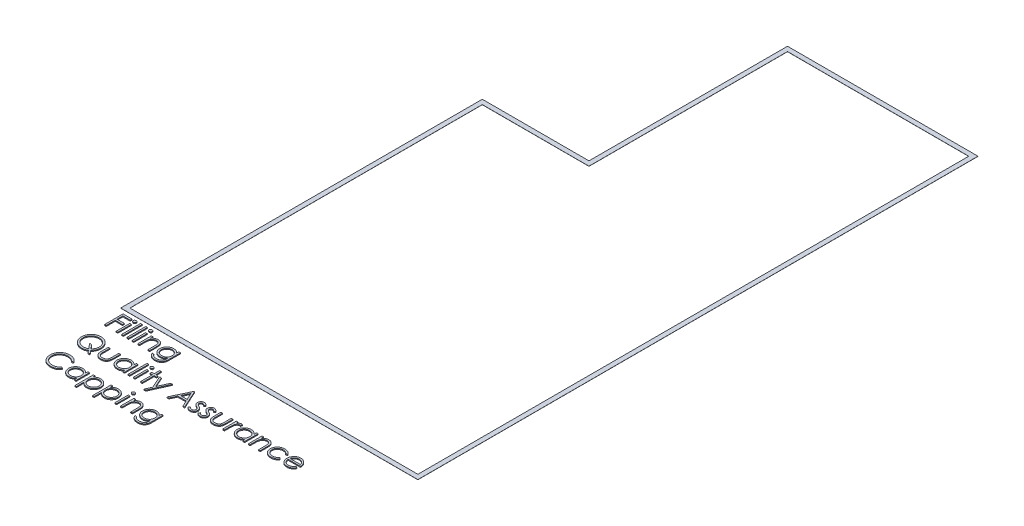
from build123d import *

# Parameters (mm, degrees)
BOSS_EXTRUDE1_DEPTH    = 0.3
BOSS_EXTRUDE2_DEPTH    = 2
BOSS_EXTRUDE2_2_DEPTH  = 2
SKETCH3_W              = 3.58974359
SKETCH3_H              = 29.23076923
BOSS_EXTRUDE2_3_DEPTH  = 2
SKETCH3_H_2            = 41.025641025
BOSS_EXTRUDE2_4_DEPTH  = 2
BOSS_EXTRUDE2_5_DEPTH  = 2
BOSS_EXTRUDE2_6_DEPTH  = 2
BOSS_EXTRUDE2_7_DEPTH  = 2
BOSS_EXTRUDE2_8_DEPTH  = 2
BOSS_EXTRUDE2_9_DEPTH  = 2
BOSS_EXTRUDE2_10_DEPTH = 2
BOSS_EXTRUDE2_11_DEPTH = 2
BOSS_EXTRUDE2_12_DEPTH = 2
SKETCH3_W_2            = 3.589743589
SKETCH3_H_3            = 41.025641026
BOSS_EXTRUDE2_13_DEPTH = 2
BOSS_EXTRUDE2_14_DEPTH = 2
SKETCH3_H_4            = 29.230769231
BOSS_EXTRUDE2_15_DEPTH = 2
BOSS_EXTRUDE2_16_DEPTH = 2
BOSS_EXTRUDE2_17_DEPTH = 2
BOSS_EXTRUDE2_18_DEPTH = 2
BOSS_EXTRUDE2_19_DEPTH = 2
BOSS_EXTRUDE2_20_DEPTH = 2
BOSS_EXTRUDE2_21_DEPTH = 2
BOSS_EXTRUDE2_22_DEPTH = 2
BOSS_EXTRUDE2_23_DEPTH = 2
BOSS_EXTRUDE2_24_DEPTH = 2
BOSS_EXTRUDE2_25_DEPTH = 2
BOSS_EXTRUDE2_26_DEPTH = 2
BOSS_EXTRUDE2_27_DEPTH = 2
BOSS_EXTRUDE2_28_DEPTH = 2
BOSS_EXTRUDE2_29_DEPTH = 2
BOSS_EXTRUDE2_30_DEPTH = 2
BOSS_EXTRUDE2_31_DEPTH = 2
BOSS_EXTRUDE2_32_DEPTH = 2
BOSS_EXTRUDE2_33_DEPTH = 2
BOSS_EXTRUDE2_34_DEPTH = 2


with BuildPart() as part:
    # Sketch1 → Boss-Extrude1 (new body)
    with BuildSketch(Plane(origin=(0, 0, 0), x_dir=(1, 0, 0), z_dir=(0, 1, 0))):
        Polygon((-320.336444653, 176.835908855), (-89.864007123, 176.835908855), (-89.864007123, 605.662040667), (321.660525986, 605.662040667), (321.660525986, -604.337959333), (-320.336444653, -604.337959333), align=None)
        Polygon((-310.336444653, 166.835908855), (-79.864007123, 166.835908855), (-79.864007123, 595.662040667), (311.660525986, 595.662040667), (311.660525986, -594.337959333), (-310.336444653, -594.337959333), align=None, mode=Mode.SUBTRACT)
    extrude(amount=BOSS_EXTRUDE1_DEPTH)


with BuildPart() as body_2:
    # Sketch3 → Boss-Extrude2 (new body)
    with BuildSketch(Plane(origin=(0, 0, 0), x_dir=(1, 0, 0), z_dir=(0, 1, 0))):
        Polygon((-305.208239525, -614.337959333), (-285.721060038, -614.337959333), (-285.721060038, -618.440523436), (-301.618495935, -618.440523436), (-301.618495935, -630.748215744), (-285.721060038, -630.748215744), (-285.721060038, -634.850779846), (-301.618495935, -634.850779846), (-301.618495935, -654.337959333), (-305.208239525, -654.337959333), align=None)
    extrude(amount=BOSS_EXTRUDE2_DEPTH)


with BuildPart() as body_3:
    # Sketch3 → Boss-Extrude2 2 (new body)
    with BuildSketch(Plane(origin=(0, 0, 0), x_dir=(1, 0, 0), z_dir=(0, 1, 0))):
        with BuildLine():
            add(Edge.make_bspline(
                [(-278.301188243, -612.799497795), (-278.078430348, -612.809830965), (-277.642227607, -612.830065297), (-277.011447405, -613.003339321), (-276.437081553, -613.297050012), (-275.927621748, -613.691103508), (-275.490457329, -614.154525719), (-275.184392068, -614.694651071), (-274.987678969, -615.278178371), (-274.963924052, -615.685207962), (-274.951829269, -615.892446513)],
                knots=[0, 0, 0, 0, 1.055194115, 2.066272739, 3.074728998, 4.095836921, 5.109056067, 6.073838105, 7.019297344, 8, 8, 8, 8], degree=3))
            add(Edge.make_bspline(
                [(-274.951829269, -615.892446513), (-274.964196809, -616.094305406), (-274.988645974, -616.493356549), (-275.184240125, -617.066767658), (-275.493065701, -617.599388041), (-275.927341422, -618.061910443), (-276.437155834, -618.455746101), (-277.011427672, -618.749514545), (-277.642232798, -618.922773258), (-278.078432103, -618.943009701), (-278.301188243, -618.953343949)],
                knots=[0, 0, 0, 0, 0.96129708, 1.900370562, 2.859976407, 3.87933698, 4.906634145, 5.921202961, 6.938410037, 8, 8, 8, 8], degree=3))
            add(Edge.make_bspline(
                [(-278.301188243, -618.953343949), (-278.521397102, -618.943404289), (-278.950004875, -618.92405804), (-279.571340216, -618.74611498), (-280.140808666, -618.455645574), (-280.651262068, -618.064489172), (-281.07674999, -617.59654749), (-281.386445137, -617.067092703), (-281.581587559, -616.493273793), (-281.6060976, -616.094277607), (-281.618495935, -615.892446513)],
                knots=[0, 0, 0, 0, 1.054934014, 2.053291228, 3.073705704, 4.106921865, 5.123545215, 6.088680038, 7.033164197, 8, 8, 8, 8], degree=3))
            add(Edge.make_bspline(
                [(-281.618495935, -615.892446513), (-281.606369231, -615.685236803), (-281.582551619, -615.278263859), (-281.386298863, -614.694320626), (-281.079329631, -614.157389177), (-280.650980334, -613.688526326), (-280.140883645, -613.297149929), (-279.571320843, -613.006738711), (-278.950009993, -612.828780547), (-278.521398839, -612.809436383), (-278.301188243, -612.799497795)],
                knots=[0, 0, 0, 0, 0.98631895, 1.937192651, 2.907499808, 3.917963147, 4.944918757, 5.95915025, 6.951458133, 8, 8, 8, 8], degree=3))
        make_face()
    extrude(amount=BOSS_EXTRUDE2_2_DEPTH)


with BuildPart() as body_4:
    # Sketch3 → Boss-Extrude2 3 (new body)
    with BuildSketch(Plane(origin=(0, 0, 0), x_dir=(1, 0, 0), z_dir=(0, 1, 0))):
        with Locations((-278.285162602, -639.722574718)):
            Rectangle(SKETCH3_W, SKETCH3_H)
    extrude(amount=BOSS_EXTRUDE2_3_DEPTH)


with BuildPart() as body_5:
    # Sketch3 → Boss-Extrude2 4 (new body)
    with BuildSketch(Plane(origin=(0, 0, 0), x_dir=(1, 0, 0), z_dir=(0, 1, 0))):
        with Locations((-266.490290807, -633.825138821)):
            Rectangle(SKETCH3_W, SKETCH3_H_2)
    extrude(amount=BOSS_EXTRUDE2_4_DEPTH)


with BuildPart() as body_6:
    # Sketch3 → Boss-Extrude2 5 (new body)
    with BuildSketch(Plane(origin=(0, 0, 0), x_dir=(1, 0, 0), z_dir=(0, 1, 0))):
        with Locations((-255.208239525, -633.825138821)):
            Rectangle(SKETCH3_W, SKETCH3_H_2)
    extrude(amount=BOSS_EXTRUDE2_5_DEPTH)


with BuildPart() as body_7:
    # Sketch3 → Boss-Extrude2 6 (new body)
    with BuildSketch(Plane(origin=(0, 0, 0), x_dir=(1, 0, 0), z_dir=(0, 1, 0))):
        with BuildLine():
            add(Edge.make_bspline(
                [(-243.942213884, -612.799497795), (-243.719455989, -612.809830965), (-243.283253248, -612.830065297), (-242.652473046, -613.003339321), (-242.078107194, -613.297050012), (-241.568647389, -613.691103508), (-241.13148297, -614.154525719), (-240.825417709, -614.694651071), (-240.62870461, -615.278178371), (-240.604949693, -615.685207962), (-240.59285491, -615.892446513)],
                knots=[0, 0, 0, 0, 1.055194115, 2.066272739, 3.074728998, 4.095836921, 5.109056067, 6.073838105, 7.019297344, 8, 8, 8, 8], degree=3))
            add(Edge.make_bspline(
                [(-240.59285491, -615.892446513), (-240.60522245, -616.094305406), (-240.629671615, -616.493356549), (-240.825265766, -617.066767658), (-241.134091342, -617.599388041), (-241.568367063, -618.061910443), (-242.078181475, -618.455746101), (-242.652453313, -618.749514545), (-243.283258439, -618.922773258), (-243.719457744, -618.943009701), (-243.942213884, -618.953343949)],
                knots=[0, 0, 0, 0, 0.96129708, 1.900370562, 2.859976407, 3.87933698, 4.906634145, 5.921202961, 6.938410037, 8, 8, 8, 8], degree=3))
            add(Edge.make_bspline(
                [(-243.942213884, -618.953343949), (-244.162422743, -618.943404289), (-244.591030516, -618.92405804), (-245.212365857, -618.74611498), (-245.781834307, -618.455645574), (-246.292287709, -618.064489172), (-246.717775631, -617.59654749), (-247.027470778, -617.067092703), (-247.2226132, -616.493273793), (-247.247123241, -616.094277607), (-247.259521576, -615.892446513)],
                knots=[0, 0, 0, 0, 1.054934014, 2.053291228, 3.073705704, 4.106921865, 5.123545215, 6.088680038, 7.033164197, 8, 8, 8, 8], degree=3))
            add(Edge.make_bspline(
                [(-247.259521576, -615.892446513), (-247.247394872, -615.685236803), (-247.22357726, -615.278263859), (-247.027324504, -614.694320626), (-246.720355272, -614.157389177), (-246.292005975, -613.688526326), (-245.781909286, -613.297149929), (-245.212346484, -613.006738711), (-244.591035634, -612.828780547), (-244.16242448, -612.809436383), (-243.942213884, -612.799497795)],
                knots=[0, 0, 0, 0, 0.98631895, 1.937192651, 2.907499808, 3.917963147, 4.944918757, 5.95915025, 6.951458133, 8, 8, 8, 8], degree=3))
        make_face()
    extrude(amount=BOSS_EXTRUDE2_6_DEPTH)


with BuildPart() as body_8:
    # Sketch3 → Boss-Extrude2 7 (new body)
    with BuildSketch(Plane(origin=(0, 0, 0), x_dir=(1, 0, 0), z_dir=(0, 1, 0))):
        with Locations((-243.926188243, -639.722574718)):
            Rectangle(SKETCH3_W, SKETCH3_H)
    extrude(amount=BOSS_EXTRUDE2_7_DEPTH)


with BuildPart() as body_9:
    # Sketch3 → Boss-Extrude2 8 (new body)
    with BuildSketch(Plane(origin=(0, 0, 0), x_dir=(1, 0, 0), z_dir=(0, 1, 0))):
        with BuildLine():
            Line((-233.41336773, -625.107190103), (-229.82362414, -625.107190103))
            Line((-229.82362414, -625.107190103), (-229.82362414, -630.379626))
            add(Edge.make_bspline(
                [(-229.82362414, -630.379626), (-229.440336882, -629.901423453), (-228.696554584, -628.973454728), (-227.457876489, -627.753791019), (-226.148803343, -626.748702732), (-224.777351874, -625.947516516), (-223.34166033, -625.343555074), (-221.850480102, -624.907373005), (-220.294883461, -624.645832107), (-219.237004183, -624.611658046), (-218.701829269, -624.59436959)],
                knots=[0, 0, 0, 0, 1.12780773, 2.188550248, 3.19190651, 4.159438251, 5.104880172, 6.052711206, 7.014878035, 8, 8, 8, 8], degree=3))
            add(Edge.make_bspline(
                [(-218.701829269, -624.59436959), (-218.160907736, -624.614314681), (-217.102193818, -624.653352034), (-215.56073026, -624.962114218), (-214.121034332, -625.489488563), (-212.788239409, -626.211912224), (-211.586785542, -627.11027192), (-210.531644382, -628.156875141), (-209.658921555, -629.360716092), (-209.073808835, -630.477552163), (-208.688372861, -631.46828124), (-208.445717575, -632.316815527), (-208.239649216, -633.262165826), (-208.061000667, -634.301475416), (-207.940119388, -635.442026161), (-207.844778914, -636.679142642), (-207.776450979, -638.012424133), (-207.773740042, -638.934557018), (-207.772342089, -639.410074718)],
                knots=[0, 0, 0, 0, 1.235846778, 2.418850247, 3.575807741, 4.728682307, 5.871620074, 6.994088408, 8.11269785, 9.256955736, 9.865816715, 10.540099792, 11.271859618, 12.076849838, 12.949306005, 13.892391288, 14.913166135, 16, 16, 16, 16], degree=3))
            Line((-207.772342089, -639.410074718), (-207.772342089, -654.337959333))
            Line((-207.772342089, -654.337959333), (-211.362085679, -654.337959333))
            Line((-211.362085679, -654.337959333), (-211.362085679, -640.587959333))
            add(Edge.make_bspline(
                [(-211.362085679, -640.587959333), (-211.36429377, -640.189988534), (-211.368517474, -639.428738125), (-211.38183915, -638.338806432), (-211.413951226, -637.350388393), (-211.459074802, -636.465847051), (-211.525120865, -635.686031776), (-211.593950938, -635.009354328), (-211.678122101, -634.436673843), (-211.753126823, -634.091930044), (-211.786765166, -633.937318308)],
                knots=[0, 0, 0, 0, 1.430800155, 2.736877192, 3.918605307, 4.986035426, 5.920637409, 6.731861385, 7.431261377, 8, 8, 8, 8], degree=3))
            add(Edge.make_bspline(
                [(-211.786765166, -633.937318308), (-211.908199812, -633.483476194), (-212.141923934, -632.609970541), (-212.719455169, -631.425120797), (-213.448760093, -630.417141508), (-214.339021228, -629.592264689), (-215.381639236, -628.950312269), (-216.573720867, -628.504895644), (-217.903762475, -628.22630971), (-218.839241134, -628.198571059), (-219.326829269, -628.18411318)],
                knots=[0, 0, 0, 0, 1.084156227, 2.086665306, 3.027808233, 3.945421172, 4.874247719, 5.839848303, 6.874090471, 8, 8, 8, 8], degree=3))
            add(Edge.make_bspline(
                [(-219.326829269, -628.18411318), (-219.615602795, -628.189553233), (-220.187078144, -628.200318958), (-221.034506394, -628.308333792), (-221.856496945, -628.485001856), (-222.661299334, -628.723500571), (-223.432816976, -629.051069362), (-224.195837447, -629.422833593), (-224.921629037, -629.88624173), (-225.625667861, -630.402705975), (-226.280671377, -630.975039771), (-226.890138102, -631.57897703), (-227.433429762, -632.222126788), (-227.925643194, -632.894126188), (-228.350537632, -633.604204337), (-228.721430067, -634.345510697), (-229.036123722, -635.119020969), (-229.19249735, -635.655878812), (-229.270739525, -635.924497795)],
                knots=[0, 0, 0, 0, 1.023777757, 2.026029729, 3.023749952, 4.003683103, 4.997618607, 5.993177895, 7.010360494, 8.046726602, 9.087585522, 10.09234134, 11.086953743, 12.070360549, 13.043493632, 14.017870808, 15.008233677, 16, 16, 16, 16], degree=3))
            add(Edge.make_bspline(
                [(-229.270739525, -635.924497795), (-229.31576408, -636.121700116), (-229.413780181, -636.550999252), (-229.519645094, -637.255506902), (-229.61573167, -638.070478045), (-229.696154054, -638.994961668), (-229.745358814, -640.032194526), (-229.799009063, -641.177746959), (-229.818541189, -642.436186825), (-229.821882378, -643.312320457), (-229.82362414, -643.769049077)],
                knots=[0, 0, 0, 0, 0.615963638, 1.340920617, 2.168419149, 3.115676021, 4.16674242, 5.331190069, 6.6087489, 8, 8, 8, 8], degree=3))
            Line((-229.82362414, -643.769049077), (-229.82362414, -654.337959333))
            Line((-229.82362414, -654.337959333), (-233.41336773, -654.337959333))
            Line((-233.41336773, -654.337959333), (-233.41336773, -625.107190103))
        make_face()
    extrude(amount=BOSS_EXTRUDE2_8_DEPTH)


with BuildPart() as body_10:
    # Sketch3 → Boss-Extrude2 9 (new body)
    with BuildSketch(Plane(origin=(0, 0, 0), x_dir=(1, 0, 0), z_dir=(0, 1, 0))):
        with BuildLine():
            Line((-173.926188243, -625.107190103), (-170.336444653, -625.107190103))
            Line((-170.336444653, -625.107190103), (-170.336444653, -648.304305487))
            add(Edge.make_bspline(
                [(-170.336444653, -648.304305487), (-170.339610854, -648.798449426), (-170.345722384, -649.752266257), (-170.389733484, -651.131446595), (-170.482541224, -652.405344715), (-170.587783297, -653.579770528), (-170.73917434, -654.649280357), (-170.924047109, -655.617065553), (-171.13245487, -656.484054838), (-171.31554307, -657.018053021), (-171.402149781, -657.270651641)],
                knots=[0, 0, 0, 0, 1.307562039, 2.523909702, 3.650326591, 4.686913197, 5.643429486, 6.506965704, 7.293745905, 8, 8, 8, 8], degree=3))
            add(Edge.make_bspline(
                [(-171.402149781, -657.270651641), (-171.530026795, -657.598993602), (-171.781957383, -658.245860311), (-172.253793194, -659.162823977), (-172.782180664, -660.02621129), (-173.385686386, -660.831210733), (-174.061581289, -661.57378116), (-174.793941199, -662.270055438), (-175.597029101, -662.905303065), (-176.470385812, -663.468563607), (-177.393878763, -663.975844226), (-178.366977072, -664.415233566), (-179.384193511, -664.79794035), (-180.455083701, -665.084600873), (-181.562857809, -665.332997679), (-182.720542735, -665.494651231), (-183.921374699, -665.604674752), (-184.737893328, -665.614848844), (-185.152149781, -665.620010615)],
                knots=[0, 0, 0, 0, 0.981931301, 1.934503488, 2.87077864, 3.801706999, 4.735015492, 5.667491629, 6.616593066, 7.585388521, 8.561939025, 9.551802639, 10.560317337, 11.588439944, 12.640189604, 13.723962949, 14.845264515, 16, 16, 16, 16], degree=3))
            add(Edge.make_bspline(
                [(-185.152149781, -665.620010615), (-185.756546748, -665.610222206), (-186.937096408, -665.591102813), (-188.658296324, -665.368349498), (-190.292978838, -665.053442377), (-191.819544057, -664.576808918), (-193.228345164, -663.993529036), (-194.509760885, -663.32387243), (-195.652287828, -662.555994616), (-196.682272662, -661.681702034), (-197.611890835, -660.642117101), (-198.486488435, -659.416987453), (-199.32832777, -657.987651577), (-199.821683632, -656.938591998), (-200.080034397, -656.389241385)],
                knots=[0, 0, 0, 0, 1.157897085, 2.2616841, 3.32207898, 4.345638746, 5.321241055, 6.241986252, 7.112515963, 7.955008012, 8.825025602, 9.77857164, 10.836726669, 12, 12, 12, 12], degree=3))
            Line((-200.080034397, -656.389241385), (-196.490290807, -656.389241385))
            add(Edge.make_bspline(
                [(-196.490290807, -656.389241385), (-196.201579843, -656.847594251), (-195.637185462, -657.743617662), (-194.581774251, -658.903768016), (-193.425130521, -659.895235041), (-192.128219856, -660.694215316), (-190.685645966, -661.296612932), (-189.096540981, -661.726044891), (-187.347973875, -661.983145084), (-186.130622856, -662.014131302), (-185.496701063, -662.030267026)],
                knots=[0, 0, 0, 0, 0.997731894, 1.950442991, 2.880492273, 3.800895997, 4.748200782, 5.754801363, 6.83083817, 8, 8, 8, 8], degree=3))
            add(Edge.make_bspline(
                [(-185.496701063, -662.030267026), (-184.870793745, -662.013922468), (-183.664107086, -661.982411797), (-181.928893726, -661.725930149), (-180.344951576, -661.296519478), (-178.921406426, -660.695280778), (-177.675054786, -659.958704703), (-176.600632028, -659.13584671), (-175.730407158, -658.208063818), (-175.145116111, -657.353414606), (-174.781291909, -656.591995981), (-174.549609204, -655.936537741), (-174.361335267, -655.195361996), (-174.203851409, -654.370953582), (-174.073898114, -653.462134645), (-173.991579458, -652.466827177), (-173.932084469, -651.387293208), (-173.928199099, -650.6388002), (-173.926188243, -650.251420872)],
                knots=[0, 0, 0, 0, 1.570740765, 3.028230971, 4.391408896, 5.680370741, 6.894727393, 8.017376726, 9.065722033, 10.075533815, 10.603371122, 11.180248986, 11.817768598, 12.521299649, 13.286540596, 14.121245857, 15.027658897, 16, 16, 16, 16], degree=3))
            Line((-173.926188243, -650.251420872), (-173.926188243, -648.736997795))
            add(Edge.make_bspline(
                [(-173.926188243, -648.736997795), (-174.29054387, -649.170618391), (-175.012846221, -650.03023233), (-176.260244246, -651.156651035), (-177.622723282, -652.126778238), (-179.097963766, -652.922419776), (-180.649829391, -653.558778914), (-182.261512024, -654.003841324), (-183.918564084, -654.291383037), (-185.041445796, -654.322323794), (-185.608880551, -654.337959333)],
                knots=[0, 0, 0, 0, 1.012485704, 2.007162095, 2.997754123, 3.998611389, 4.999708251, 5.992315798, 6.98544096, 8, 8, 8, 8], degree=3))
            add(Edge.make_bspline(
                [(-185.608880551, -654.337959333), (-185.943009344, -654.332073317), (-186.607312859, -654.320370938), (-187.594224256, -654.21798491), (-188.566572122, -654.069427855), (-189.522088735, -653.851354267), (-190.462152885, -653.571448821), (-191.38521108, -653.221543235), (-192.298737098, -652.825941884), (-193.186125645, -652.359966987), (-194.038538568, -651.841540623), (-194.849546398, -651.279953301), (-195.61490113, -650.678144292), (-196.327318153, -650.030179266), (-196.985862969, -649.336996034), (-197.59939289, -648.605984), (-198.157762571, -647.826935527), (-198.672429876, -647.014056013), (-199.118801881, -646.161931169), (-199.510623273, -645.28903865), (-199.851302188, -644.397244884), (-200.122906779, -643.483564168), (-200.330348073, -642.548572524), (-200.484750668, -641.59380168), (-200.572327029, -640.616311535), (-200.585983304, -639.95778183), (-200.59285491, -639.626420872)],
                knots=[0, 0, 0, 0, 1.028754217, 2.045334182, 3.052854819, 4.056607503, 5.061168794, 6.071104265, 7.095078842, 8.125279047, 9.155117945, 10.165957491, 11.161587969, 12.151493252, 13.128948131, 14.104219989, 15.088194871, 16.07871515, 17.064853787, 18.047899887, 19.02414258, 20.002704429, 20.980574569, 21.971845993, 22.979467364, 24, 24, 24, 24], degree=3))
            add(Edge.make_bspline(
                [(-200.59285491, -639.626420872), (-200.586921581, -639.294956918), (-200.575077904, -638.633312817), (-200.472780997, -637.651834127), (-200.326858832, -636.683497724), (-200.095912901, -635.738284676), (-199.817941215, -634.80543037), (-199.473671814, -633.891825154), (-199.059743136, -632.997190764), (-198.591060282, -632.120864691), (-198.064384938, -631.274606234), (-197.486870871, -630.470873138), (-196.85782088, -629.715579745), (-196.185913273, -629.001106352), (-195.462943935, -628.33434643), (-194.68928688, -627.71691826), (-193.872568249, -627.138472245), (-193.01025682, -626.611485535), (-192.115658094, -626.145402717), (-191.211500176, -625.720115895), (-190.285806062, -625.382583101), (-189.355834183, -625.085176255), (-188.405206585, -624.874488309), (-187.44557923, -624.711948402), (-186.473666798, -624.612923018), (-185.822776569, -624.600562047), (-185.496701063, -624.59436959)],
                knots=[0, 0, 0, 0, 1.008818848, 2.013730394, 3.001654427, 3.987803273, 4.973046549, 5.963777569, 6.957074694, 7.972068341, 8.987420212, 9.989399531, 10.982630087, 11.977756091, 12.973280677, 13.973972381, 14.989194003, 16.018387222, 17.047741039, 18.059210846, 19.057554164, 20.045176975, 21.029480261, 22.018708529, 23.007435371, 24, 24, 24, 24], degree=3))
            add(Edge.make_bspline(
                [(-185.496701063, -624.59436959), (-184.958976046, -624.609874427), (-183.897134363, -624.640491717), (-182.334494335, -624.880733379), (-180.826583021, -625.263750674), (-179.364891413, -625.812500737), (-177.937512545, -626.561644033), (-176.54915077, -627.548420581), (-175.195789236, -628.781681607), (-174.36061403, -629.727428628), (-173.926188243, -630.21936959)],
                knots=[0, 0, 0, 0, 0.96728863, 1.910097829, 2.838038873, 3.762875196, 4.71315279, 5.730631239, 6.819562287, 8, 8, 8, 8], degree=3))
            Line((-173.926188243, -630.21936959), (-173.926188243, -625.107190103))
        make_face()
        with BuildLine():
            add(Edge.make_bspline(
                [(-185.208239525, -628.18411318), (-185.733161855, -628.201953928), (-186.772396762, -628.237274827), (-188.295692105, -628.538814406), (-189.76628563, -629.011338978), (-191.156061952, -629.687254583), (-192.457857494, -630.511188731), (-193.612998299, -631.509363446), (-194.623340198, -632.649319982), (-195.47800235, -633.920751376), (-196.158360824, -635.292434524), (-196.639999903, -636.738271486), (-196.951428741, -638.234899975), (-196.985801907, -639.256301154), (-197.00311132, -639.770651641)],
                knots=[0, 0, 0, 0, 1.026226791, 2.031711442, 3.026614839, 4.04107745, 5.047145931, 6.032893242, 7.017642609, 8.019221815, 9.021877557, 10.003543541, 10.994637589, 12, 12, 12, 12], degree=3))
            add(Edge.make_bspline(
                [(-197.00311132, -639.770651641), (-196.994816956, -640.15846047), (-196.978504368, -640.92116703), (-196.821663479, -642.040457256), (-196.568166735, -643.106517983), (-196.208884377, -644.119413691), (-195.763710721, -645.084954204), (-195.20379791, -645.996488315), (-194.544929662, -646.854827813), (-193.792262943, -647.653624176), (-192.962818579, -648.381178101), (-192.063170587, -649.020469994), (-191.094539161, -649.543335376), (-190.080747045, -649.995230663), (-188.997195548, -650.325277154), (-187.859491707, -650.577148914), (-186.659586604, -650.721249), (-185.84162387, -650.739109547), (-185.424585679, -650.748215744)],
                knots=[0, 0, 0, 0, 1.039728707, 2.044842319, 3.024901384, 3.974314358, 4.923051295, 5.871625912, 6.837440708, 7.820715446, 8.810779094, 9.792721783, 10.773906224, 11.758876063, 12.764959493, 13.806266761, 14.881525401, 16, 16, 16, 16], degree=3))
            add(Edge.make_bspline(
                [(-185.424585679, -650.748215744), (-185.002142728, -650.739443069), (-184.176060014, -650.722288196), (-182.969535027, -650.574819642), (-181.826303708, -650.336854198), (-180.74741431, -649.998991052), (-179.728793269, -649.56788533), (-178.781883388, -649.022323987), (-177.886381124, -648.401016192), (-177.0708793, -647.676307458), (-176.333460266, -646.877621801), (-175.69082293, -646.008537287), (-175.143229227, -645.082131355), (-174.689770143, -644.098508433), (-174.343584952, -643.050024398), (-174.111368895, -641.939300332), (-173.949006093, -640.771657602), (-173.933909811, -639.971559132), (-173.926188243, -639.562318308)],
                knots=[0, 0, 0, 0, 1.121943988, 2.193949579, 3.223793937, 4.220241907, 5.192961521, 6.155822191, 7.11847367, 8.083710714, 9.04790392, 10.001595906, 10.949595423, 11.902125208, 12.873731292, 13.87582262, 14.913508608, 16, 16, 16, 16], degree=3))
            add(Edge.make_bspline(
                [(-173.926188243, -639.562318308), (-173.941497593, -639.029542834), (-173.971406685, -637.988686777), (-174.253659915, -636.472038), (-174.708748031, -635.0461103), (-175.346996629, -633.715413432), (-176.146791014, -632.49404715), (-177.110115, -631.404631785), (-178.22035535, -630.445764853), (-179.474322209, -629.646928355), (-180.823435868, -629.001609104), (-182.235106681, -628.517474566), (-183.707238839, -628.243253823), (-184.705026377, -628.203940185), (-185.208239525, -628.18411318)],
                knots=[0, 0, 0, 0, 1.070913519, 2.092188694, 3.091357305, 4.074328408, 5.051968682, 6.018948707, 6.99050112, 7.9935919, 9.000589572, 9.992915277, 10.987769056, 12, 12, 12, 12], degree=3))
        make_face(mode=Mode.SUBTRACT)
    extrude(amount=BOSS_EXTRUDE2_9_DEPTH)


with BuildPart() as body_11:
    # Sketch3 → Boss-Extrude2 10 (new body)
    with BuildSketch(Plane(origin=(0, 0, 0), x_dir=(1, 0, 0), z_dir=(0, 1, 0))):
        with BuildLine():
            Line((-271.866893371, -717.549497795), (-265.721060038, -725.081549077))
            Line((-265.721060038, -725.081549077), (-270.200226704, -725.081549077))
            Line((-270.200226704, -725.081549077), (-274.639329269, -719.648856769))
            add(Edge.make_bspline(
                [(-274.639329269, -719.648856769), (-275.084553187, -719.919413748), (-275.966799636, -720.455543826), (-277.342418354, -721.146585732), (-278.745393213, -721.721622735), (-280.172619989, -722.196708154), (-281.622019856, -722.576986159), (-283.100942579, -722.840915178), (-284.604024223, -722.994175474), (-285.613880246, -723.018190646), (-286.121701063, -723.030267026)],
                knots=[0, 0, 0, 0, 1.030216282, 2.041455142, 3.041201647, 4.026904037, 5.014869161, 6.002481075, 6.995518502, 8, 8, 8, 8], degree=3))
            add(Edge.make_bspline(
                [(-286.121701063, -723.030267026), (-286.849247816, -723.012743067), (-288.280843245, -722.978261132), (-290.38335887, -722.677227341), (-292.401457374, -722.212307122), (-294.331116239, -721.539613811), (-296.174437519, -720.68038544), (-297.930564811, -719.621079432), (-299.600390697, -718.376368402), (-301.159266014, -716.954386923), (-302.584699358, -715.40746914), (-303.835427799, -713.754657271), (-304.898884901, -712.023377734), (-305.758753317, -710.204997184), (-306.441173826, -708.315345901), (-306.906224896, -706.338708247), (-307.207247042, -704.286850865), (-307.24192553, -702.889786054), (-307.259521576, -702.180908051)],
                knots=[0, 0, 0, 0, 1.055750571, 2.07740284, 3.077223765, 4.05828044, 5.038417088, 6.02463293, 7.030503776, 8.057169806, 9.083586829, 10.080154041, 11.061747002, 12.027853603, 12.995569715, 13.972756451, 14.971366004, 16, 16, 16, 16], degree=3))
            add(Edge.make_bspline(
                [(-307.259521576, -702.180908051), (-307.25326109, -701.705121952), (-307.240784103, -700.756892555), (-307.09645094, -699.352467736), (-306.882007621, -697.971163384), (-306.57868587, -696.618719644), (-306.181612399, -695.289593041), (-305.705562301, -693.986404419), (-305.128764241, -692.712511749), (-304.476708031, -691.470522298), (-303.749478318, -690.271200461), (-302.957290481, -689.131615787), (-302.098195669, -688.062998952), (-301.172802064, -687.065838887), (-300.18480539, -686.13793136), (-299.142701622, -685.26399652), (-298.024271031, -684.476545668), (-296.859032462, -683.744247964), (-295.640451381, -683.100293538), (-294.392363216, -682.524618856), (-293.105431585, -682.057531391), (-291.796354531, -681.659516287), (-290.457190026, -681.355654467), (-289.088981763, -681.142783164), (-287.692692285, -680.99705783), (-286.749747823, -680.98504604), (-286.273944653, -680.978984974)],
                knots=[0, 0, 0, 0, 1.030721839, 2.054201982, 3.056261636, 4.058906239, 5.055198403, 6.060579377, 7.06322398, 8.083343201, 9.098870418, 10.10084648, 11.0888991, 12.067804703, 13.046436456, 14.024708667, 15.012489976, 16.008294399, 17.005242112, 17.997338632, 18.984424362, 19.969624474, 20.960977749, 21.957320355, 22.969278161, 24, 24, 24, 24], degree=3))
            add(Edge.make_bspline(
                [(-286.273944653, -680.978984974), (-285.546395183, -680.996420954), (-284.117441465, -681.030666333), (-282.020134464, -681.331745525), (-280.007981188, -681.798531379), (-278.082414051, -682.467796477), (-276.245149852, -683.329188696), (-274.496960466, -684.388281187), (-272.835135512, -685.633074674), (-271.284405822, -687.055151372), (-269.862329646, -688.605880988), (-268.617534199, -690.267705719), (-267.558448851, -692.01589604), (-266.697030202, -693.853156747), (-266.027864569, -695.778737035), (-265.560099702, -697.793420734), (-265.260458106, -699.893614089), (-265.225835151, -701.325174146), (-265.208239525, -702.052702923)],
                knots=[0, 0, 0, 0, 1.050672203, 2.063587442, 3.054842799, 4.031180399, 5.003107577, 5.981273811, 6.979214548, 7.998088659, 9.016962771, 10.014903508, 10.993069742, 11.96499692, 12.941334519, 13.932589877, 14.949327797, 16, 16, 16, 16], degree=3))
            add(Edge.make_bspline(
                [(-265.208239525, -702.052702923), (-265.227469445, -702.809701394), (-265.265283995, -704.298296027), (-265.587092315, -706.481161461), (-266.104503593, -708.566312166), (-266.838255272, -710.55238194), (-267.786830375, -712.439009793), (-268.931903134, -714.24506219), (-270.287260339, -715.970411078), (-271.334803826, -717.017592273), (-271.866893371, -717.549497795)],
                knots=[0, 0, 0, 0, 1.045660934, 2.056233022, 3.041853582, 4.009978652, 4.97562384, 5.954545411, 6.961031197, 8, 8, 8, 8], degree=3))
        make_face()
        with BuildLine():
            add(Edge.make_bspline(
                [(-274.278752345, -714.592767026), (-273.842310279, -714.149533048), (-272.983809382, -713.277672161), (-271.869921349, -711.847866438), (-270.911865896, -710.361612354), (-270.144838207, -708.799139211), (-269.534563102, -707.180022495), (-269.112930035, -705.491432955), (-268.848929104, -703.741057843), (-268.815089972, -702.550436645), (-268.797983115, -701.948536257)],
                knots=[0, 0, 0, 0, 1.052210109, 2.069743939, 3.061837814, 4.040478349, 5.010453814, 5.985306305, 6.981502329, 8, 8, 8, 8], degree=3))
            add(Edge.make_bspline(
                [(-268.797983115, -701.948536257), (-268.802452881, -701.560919883), (-268.81128882, -700.79467062), (-268.932782813, -699.660756142), (-269.104660678, -698.551885633), (-269.353487142, -697.470040352), (-269.67391449, -696.417412162), (-270.069670413, -695.395430022), (-270.53304423, -694.400796932), (-271.073236853, -693.439691515), (-271.668753512, -692.513506776), (-272.331636614, -691.633569515), (-273.052555697, -690.804416939), (-273.823635054, -690.012384998), (-274.659741084, -689.273800391), (-275.557875197, -688.58897972), (-276.506970348, -687.941350514), (-277.511723059, -687.356781554), (-278.547120425, -686.819361618), (-279.60710394, -686.353989211), (-280.682773252, -685.959835456), (-281.772462628, -685.640227377), (-282.874762003, -685.388655117), (-283.991603932, -685.216969576), (-285.120100258, -685.095600691), (-285.878322767, -685.086236941), (-286.257919012, -685.081549077)],
                knots=[0, 0, 0, 0, 1.032958288, 2.041976502, 3.037103433, 4.023477888, 4.998866292, 5.968231228, 6.943073582, 7.921783703, 8.90545537, 9.876780072, 10.85618943, 11.833110341, 12.821898168, 13.827467856, 14.842673888, 15.88323808, 16.924703457, 17.951432745, 18.967462636, 19.976958182, 20.977218729, 21.979378626, 22.98839684, 24, 24, 24, 24], degree=3))
            add(Edge.make_bspline(
                [(-286.257919012, -685.081549077), (-286.640179145, -685.086269652), (-287.403717517, -685.095698678), (-288.537662042, -685.216298305), (-289.657067125, -685.388844115), (-290.757009404, -685.639166032), (-291.841384166, -685.959395661), (-292.906825597, -686.355932293), (-293.962599321, -686.809810199), (-294.986797058, -687.346886988), (-295.977626827, -687.936482671), (-296.919968632, -688.577672326), (-297.800908353, -689.276853128), (-298.628802546, -690.022768319), (-299.401583405, -690.821173202), (-300.122899623, -691.666756827), (-300.780083624, -692.569330541), (-301.382187791, -693.512745873), (-301.914356017, -694.498027844), (-302.394304231, -695.507399614), (-302.784128792, -696.551989369), (-303.104166488, -697.623436244), (-303.36568573, -698.719076539), (-303.534245031, -699.845270408), (-303.656650359, -700.994987453), (-303.665368419, -701.771914935), (-303.669777986, -702.16488241)],
                knots=[0, 0, 0, 0, 1.013205451, 2.023808328, 3.020541854, 4.015386314, 5.012622987, 6.016502547, 7.02834558, 8.057881235, 9.080621846, 10.084476421, 11.077781791, 12.060654405, 13.037357686, 14.022218736, 15.005346502, 15.995617173, 16.98763393, 17.973029642, 18.956998942, 19.940662314, 20.93709383, 21.940823471, 22.958474994, 24, 24, 24, 24], degree=3))
            add(Edge.make_bspline(
                [(-303.669777986, -702.16488241), (-303.654765911, -702.742629968), (-303.625232515, -703.879238146), (-303.380408019, -705.547975122), (-302.969929021, -707.145535009), (-302.395651859, -708.674203311), (-301.674725653, -710.142790992), (-300.778199399, -711.536910796), (-299.709897939, -712.851252715), (-298.510235571, -714.094844479), (-297.190589062, -715.22148882), (-295.791635769, -716.213058857), (-294.325319628, -717.054318171), (-292.787036157, -717.733312594), (-291.188256394, -718.27856809), (-289.516359608, -718.647716956), (-287.782275045, -718.892398747), (-286.600658946, -718.915824608), (-286.001508756, -718.927702923)],
                knots=[0, 0, 0, 0, 1.022526523, 2.011626, 2.97850031, 3.937665323, 4.897797383, 5.869804095, 6.865337375, 7.89202157, 8.925035373, 9.93268082, 10.923937058, 11.912550332, 12.905497077, 13.90928476, 14.939882052, 16, 16, 16, 16], degree=3))
            add(Edge.make_bspline(
                [(-286.001508756, -718.927702923), (-285.589869853, -718.923218686), (-284.775677176, -718.914349182), (-283.575059974, -718.793427827), (-282.403823111, -718.623228529), (-281.272812536, -718.364372068), (-280.172220634, -718.042556552), (-279.108598461, -717.65109703), (-278.076303914, -717.187018474), (-277.419925979, -716.819877726), (-277.091252345, -716.636036257)],
                knots=[0, 0, 0, 0, 1.060694673, 2.097979151, 3.107774411, 4.11000626, 5.086069662, 6.061987343, 7.029562652, 8, 8, 8, 8], degree=3))
            Line((-277.091252345, -716.636036257), (-286.097662602, -705.59436959))
            Line((-286.097662602, -705.59436959), (-281.618495935, -705.59436959))
            Line((-281.618495935, -705.59436959), (-274.278752345, -714.592767026))
        make_face(mode=Mode.SUBTRACT)
    extrude(amount=BOSS_EXTRUDE2_10_DEPTH)


with BuildPart() as body_12:
    # Sketch3 → Boss-Extrude2 11 (new body)
    with BuildSketch(Plane(origin=(0, 0, 0), x_dir=(1, 0, 0), z_dir=(0, 1, 0))):
        with BuildLine():
            Line((-258.541572858, -692.773856769), (-254.951829269, -692.773856769))
            Line((-254.951829269, -692.773856769), (-254.951829269, -706.331549077))
            add(Edge.make_bspline(
                [(-254.951829269, -706.331549077), (-254.950207498, -706.729523353), (-254.947105128, -707.490829502), (-254.926065803, -708.586317351), (-254.876579018, -709.585365496), (-254.814706738, -710.488551059), (-254.735139468, -711.295721248), (-254.640472491, -712.004056757), (-254.534661958, -712.621590289), (-254.431088084, -712.993514354), (-254.382919012, -713.166484974)],
                knots=[0, 0, 0, 0, 1.388932606, 2.656963016, 3.823490214, 4.879454478, 5.816252168, 6.653371382, 7.373723809, 8, 8, 8, 8], degree=3))
            add(Edge.make_bspline(
                [(-254.382919012, -713.166484974), (-254.305645241, -713.383889214), (-254.1527042, -713.814177912), (-253.875292957, -714.435766543), (-253.532111968, -715.011484056), (-253.156571078, -715.563530602), (-252.723434991, -716.075553309), (-252.238183893, -716.546687522), (-251.717061184, -716.994734279), (-250.94271806, -717.524846188), (-249.88375502, -718.093021389), (-248.493437816, -718.583259314), (-246.985960949, -718.876240114), (-245.944078443, -718.9102316), (-245.408560038, -718.927702923)],
                knots=[0, 0, 0, 0, 0.725840625, 1.436591201, 2.137033971, 2.831655856, 3.53531722, 4.242432219, 4.957935707, 5.694543706, 7.190802206, 8.724350549, 10.316345118, 12, 12, 12, 12], degree=3))
            add(Edge.make_bspline(
                [(-245.408560038, -718.927702923), (-244.873091378, -718.909860082), (-243.837058597, -718.875337486), (-242.346144663, -718.592097045), (-240.983271355, -718.11888917), (-239.762117626, -717.458233035), (-238.68822231, -716.649752317), (-237.793314667, -715.701080218), (-237.054946043, -714.642230082), (-236.732552665, -713.852238324), (-236.570419012, -713.454946513)],
                knots=[0, 0, 0, 0, 1.157059328, 2.238695713, 3.266970494, 4.264342957, 5.228770407, 6.160125903, 7.074715775, 8, 8, 8, 8], degree=3))
            add(Edge.make_bspline(
                [(-236.570419012, -713.454946513), (-236.522484954, -713.295331671), (-236.416514459, -712.942462238), (-236.302659013, -712.343836542), (-236.200093738, -711.629955347), (-236.112514582, -710.796147248), (-236.05005558, -709.84459122), (-236.016386705, -708.775584635), (-235.978349274, -707.592483376), (-235.977771945, -706.764280413), (-235.977470294, -706.331549077)],
                knots=[0, 0, 0, 0, 0.557542046, 1.232589297, 2.036731608, 2.971723315, 4.038036528, 5.22795436, 6.551621927, 8, 8, 8, 8], degree=3))
            Line((-235.977470294, -706.331549077), (-235.977470294, -692.773856769))
            Line((-235.977470294, -692.773856769), (-232.387726704, -692.773856769))
            Line((-232.387726704, -692.773856769), (-232.387726704, -707.004626))
            add(Edge.make_bspline(
                [(-232.387726704, -707.004626), (-232.392774645, -707.488136531), (-232.402568341, -708.426213101), (-232.465509409, -709.78946009), (-232.573504982, -711.059885745), (-232.737421382, -712.238162544), (-232.930171949, -713.323390907), (-233.178815069, -714.316961718), (-233.475709214, -715.215813763), (-233.810629386, -716.035719785), (-234.206307872, -716.779112861), (-234.627188106, -717.484665051), (-235.113185499, -718.134870025), (-235.624845319, -718.76209445), (-236.1940071, -719.335140477), (-236.810005488, -719.867157344), (-237.464170286, -720.366277707), (-238.171018263, -720.813035186), (-238.920230411, -721.215511132), (-239.712731634, -721.572266311), (-240.558228757, -721.854581477), (-241.445813179, -722.098131943), (-242.379833514, -722.289154447), (-243.359389321, -722.423858067), (-244.38415065, -722.506433278), (-245.082544475, -722.513713791), (-245.44061132, -722.517446513)],
                knots=[0, 0, 0, 0, 1.493040784, 2.896703357, 4.213163133, 5.428574705, 6.569057535, 7.615249723, 8.588095153, 9.490268104, 10.346124644, 11.18633936, 12.024365274, 12.850166724, 13.684164916, 14.514361689, 15.362232829, 16.222528818, 17.093394965, 17.986930858, 18.902426812, 19.842810585, 20.827885679, 21.843828298, 22.894529745, 24, 24, 24, 24], degree=3))
            add(Edge.make_bspline(
                [(-245.44061132, -722.517446513), (-245.796000052, -722.513564146), (-246.494371996, -722.505934932), (-247.519186216, -722.424314273), (-248.501456002, -722.289363751), (-249.437689128, -722.096732695), (-250.328825098, -721.856286182), (-251.178473553, -721.570531491), (-251.976685702, -721.215325985), (-252.733051462, -720.815582471), (-253.441650184, -720.363407895), (-254.10574822, -719.867773156), (-254.724455106, -719.32941815), (-255.297907312, -718.750591211), (-255.818055615, -718.124111938), (-256.291381806, -717.455019821), (-256.725172722, -716.749944522), (-257.117776041, -715.994936951), (-257.455053247, -715.165542554), (-257.752827486, -714.247861444), (-257.996377639, -713.231832681), (-258.194577277, -712.118324927), (-258.354022312, -710.912667309), (-258.464721081, -709.60788542), (-258.526616289, -708.207157509), (-258.536479848, -707.239730195), (-258.541572858, -706.740202923)],
                knots=[0, 0, 0, 0, 1.083640291, 2.129454052, 3.13281866, 4.105697902, 5.042300162, 5.946461698, 6.836384745, 7.703652036, 8.553297018, 9.397182691, 10.228592656, 11.052265423, 11.879314572, 12.708807002, 13.549817954, 14.402308542, 15.300838682, 16.27712199, 17.341985831, 18.484375296, 19.725102775, 21.0496083, 22.476576903, 24, 24, 24, 24], degree=3))
            Line((-258.541572858, -706.740202923), (-258.541572858, -692.773856769))
        make_face()
    extrude(amount=BOSS_EXTRUDE2_11_DEPTH)


with BuildPart() as body_13:
    # Sketch3 → Boss-Extrude2 12 (new body)
    with BuildSketch(Plane(origin=(0, 0, 0), x_dir=(1, 0, 0), z_dir=(0, 1, 0))):
        with BuildLine():
            Line((-194.439008756, -692.773856769), (-194.439008756, -722.004626))
            Line((-194.439008756, -722.004626), (-198.028752345, -722.004626))
            Line((-198.028752345, -722.004626), (-198.028752345, -716.948536257))
            add(Edge.make_bspline(
                [(-198.028752345, -716.948536257), (-198.433538524, -717.406131616), (-199.223483842, -718.299134714), (-200.542810904, -719.465788114), (-201.941304366, -720.430111789), (-203.412176607, -721.208967968), (-204.954099388, -721.794020041), (-206.563654672, -722.209861859), (-208.241499024, -722.477219975), (-209.387240222, -722.503917368), (-209.96785491, -722.517446513)],
                knots=[0, 0, 0, 0, 1.074387032, 2.096679803, 3.090159297, 4.057316773, 5.018401886, 5.985159533, 6.978961417, 8, 8, 8, 8], degree=3))
            add(Edge.make_bspline(
                [(-209.96785491, -722.517446513), (-210.484060096, -722.50343083), (-211.502039581, -722.475791282), (-212.999514748, -722.261364955), (-214.440569027, -721.917014994), (-215.826564144, -721.438147685), (-217.14853152, -720.802938295), (-218.417789768, -720.042466889), (-219.627763391, -719.136857402), (-220.76000955, -718.101565649), (-221.802660983, -716.97705151), (-222.717646956, -715.777673832), (-223.480539297, -714.50861893), (-224.118483077, -713.185954314), (-224.60986987, -711.799498091), (-224.95242569, -710.354044743), (-225.166602224, -708.851303331), (-225.194230346, -707.827994496), (-225.208239525, -707.30911318)],
                knots=[0, 0, 0, 0, 1.033919861, 2.038935746, 3.024066025, 3.998881131, 4.97069526, 5.957263378, 6.95902576, 7.993208707, 9.027059324, 10.027763471, 11.009749337, 11.988697705, 12.965288445, 13.950418724, 14.960734635, 16, 16, 16, 16], degree=3))
            add(Edge.make_bspline(
                [(-225.208239525, -707.30911318), (-225.193919852, -706.800956567), (-225.165610631, -705.796358358), (-224.95471669, -704.318887524), (-224.600076591, -702.895821687), (-224.102386903, -701.531742336), (-223.464193132, -700.224998906), (-222.687872138, -698.974667191), (-221.773367856, -697.777302649), (-220.719054633, -696.661060056), (-219.576942974, -695.629967322), (-218.355128906, -694.733863945), (-217.084005691, -693.959957102), (-215.743856999, -693.346774515), (-214.354518658, -692.850670464), (-212.903622136, -692.507436542), (-211.397204094, -692.305181442), (-210.374455613, -692.275892709), (-209.855675422, -692.261036257)],
                knots=[0, 0, 0, 0, 1.020392517, 2.01726096, 2.990465484, 3.961182959, 4.928053699, 5.906110375, 6.912531644, 7.948652711, 8.985773172, 9.998621852, 10.987621588, 11.969261332, 12.953316658, 13.946091881, 14.958173133, 16, 16, 16, 16], degree=3))
            add(Edge.make_bspline(
                [(-209.855675422, -692.261036257), (-209.259105605, -692.277467703), (-208.089260348, -692.309688993), (-206.378083099, -692.577834448), (-204.759289066, -693.030845501), (-203.220382185, -693.647045479), (-201.76688863, -694.465888097), (-200.412568809, -695.498801937), (-199.143249, -696.739272645), (-198.407474238, -697.692077725), (-198.028752345, -698.182510615)],
                knots=[0, 0, 0, 0, 1.038897134, 2.037228247, 3.008116434, 3.962042015, 4.918381754, 5.904844433, 6.921570401, 8, 8, 8, 8], degree=3))
            Line((-198.028752345, -698.182510615), (-198.028752345, -692.773856769))
            Line((-198.028752345, -692.773856769), (-194.439008756, -692.773856769))
        make_face()
        with BuildLine():
            add(Edge.make_bspline(
                [(-209.807598499, -695.850779846), (-210.332333789, -695.869449992), (-211.368077789, -695.906301889), (-212.88858067, -696.193998977), (-214.343591116, -696.672680056), (-215.725831965, -697.327330355), (-217.013468727, -698.150515916), (-218.164253536, -699.146188868), (-219.187598694, -700.287183315), (-220.048264571, -701.568350291), (-220.74987025, -702.941814189), (-221.243207758, -704.377522053), (-221.568570586, -705.84957894), (-221.601810821, -706.848009634), (-221.618495935, -707.349177282)],
                knots=[0, 0, 0, 0, 1.031046209, 2.035121221, 3.029706178, 4.034933723, 5.034054252, 6.02443088, 7.017295772, 8.038157696, 9.050218397, 10.03989886, 11.016116709, 12, 12, 12, 12], degree=3))
            add(Edge.make_bspline(
                [(-221.618495935, -707.349177282), (-221.597182869, -707.847349936), (-221.554640276, -708.841742574), (-221.248918054, -710.315806309), (-220.736005215, -711.751852504), (-220.036095927, -713.13769243), (-219.159677358, -714.424367862), (-218.143807044, -715.58711212), (-216.978660971, -716.586993129), (-215.688060891, -717.42399397), (-214.309684086, -718.100137066), (-212.860153441, -718.570601518), (-211.366717576, -718.874347582), (-210.351262332, -718.909827317), (-209.839649781, -718.927702923)],
                knots=[0, 0, 0, 0, 0.979072187, 1.954306742, 2.945804271, 3.96968567, 4.997920485, 5.998718438, 6.996577872, 8.005894225, 9.015743152, 10.005417472, 10.995077863, 12, 12, 12, 12], degree=3))
            add(Edge.make_bspline(
                [(-209.839649781, -718.927702923), (-209.320261178, -718.908731907), (-208.287248761, -718.871000437), (-206.762234957, -718.582071691), (-205.282292525, -718.104713995), (-203.867581343, -717.44300969), (-202.549682701, -716.622925622), (-201.366849814, -715.662844582), (-200.366667319, -714.546236764), (-199.518751781, -713.3190773), (-198.853889876, -711.973797341), (-198.369592056, -710.541406589), (-198.083261704, -709.021855182), (-198.047173366, -707.983410302), (-198.028752345, -707.453343949)],
                knots=[0, 0, 0, 0, 1.01762866, 2.023962475, 3.030623092, 4.058876274, 5.077231937, 6.066672613, 7.034107872, 8.005628644, 8.981990164, 9.965428785, 10.961468474, 12, 12, 12, 12], degree=3))
            add(Edge.make_bspline(
                [(-198.028752345, -707.453343949), (-198.039719847, -707.049483029), (-198.06130736, -706.254556933), (-198.226228155, -705.087385304), (-198.488570171, -703.970428435), (-198.858240686, -702.902511989), (-199.343855365, -701.889540384), (-199.929544118, -700.924240267), (-200.6256064, -700.011632137), (-201.420837213, -699.164282755), (-202.29129667, -698.3914089), (-203.212377135, -697.701531864), (-204.194991386, -697.134803032), (-205.222614665, -696.665759929), (-206.297029916, -696.292512502), (-207.426979857, -696.043510288), (-208.600453993, -695.87253519), (-209.40098034, -695.858107981), (-209.807598499, -695.850779846)],
                knots=[0, 0, 0, 0, 1.050140795, 2.067009409, 3.05949893, 4.030605086, 5.00011959, 5.97591094, 6.962425594, 7.979863591, 8.993523472, 9.986985069, 10.967611495, 11.937549037, 12.921786183, 13.919465291, 14.943216303, 16, 16, 16, 16], degree=3))
        make_face(mode=Mode.SUBTRACT)
    extrude(amount=BOSS_EXTRUDE2_12_DEPTH)


with BuildPart() as body_14:
    # Sketch3 → Boss-Extrude2 13 (new body)
    with BuildSketch(Plane(origin=(0, 0, 0), x_dir=(1, 0, 0), z_dir=(0, 1, 0))):
        with Locations((-184.951829269, -701.491805487)):
            Rectangle(SKETCH3_W_2, SKETCH3_H_3)
    extrude(amount=BOSS_EXTRUDE2_13_DEPTH)


with BuildPart() as body_15:
    # Sketch3 → Boss-Extrude2 14 (new body)
    with BuildSketch(Plane(origin=(0, 0, 0), x_dir=(1, 0, 0), z_dir=(0, 1, 0))):
        with BuildLine():
            add(Edge.make_bspline(
                [(-173.685803627, -680.466164462), (-173.463045733, -680.476497632), (-173.026842992, -680.496731964), (-172.39606279, -680.670005988), (-171.821696937, -680.963716678), (-171.312237133, -681.357770174), (-170.875072714, -681.821192385), (-170.569007452, -682.361317737), (-170.372294354, -682.944845038), (-170.348539436, -683.351874628), (-170.336444653, -683.55911318)],
                knots=[0, 0, 0, 0, 1.055194115, 2.066272739, 3.074728998, 4.095836921, 5.109056067, 6.073838105, 7.019297344, 8, 8, 8, 8], degree=3))
            add(Edge.make_bspline(
                [(-170.336444653, -683.55911318), (-170.348812194, -683.760972073), (-170.373261359, -684.160023216), (-170.56885551, -684.733434325), (-170.877681085, -685.266054708), (-171.311956807, -685.72857711), (-171.821771218, -686.122412767), (-172.396043057, -686.416181212), (-173.026848182, -686.589439925), (-173.463047487, -686.609676367), (-173.685803627, -686.620010615)],
                knots=[0, 0, 0, 0, 0.96129708, 1.900370562, 2.859976407, 3.87933698, 4.906634145, 5.921202961, 6.938410037, 8, 8, 8, 8], degree=3))
            add(Edge.make_bspline(
                [(-173.685803627, -686.620010615), (-173.906012487, -686.610070956), (-174.33462026, -686.590724707), (-174.955955601, -686.412781647), (-175.525424051, -686.12231224), (-176.035877453, -685.731155839), (-176.461365374, -685.263214156), (-176.771060522, -684.73375937), (-176.966202943, -684.15994046), (-176.990712985, -683.760944273), (-177.00311132, -683.55911318)],
                knots=[0, 0, 0, 0, 1.054934014, 2.053291228, 3.073705704, 4.106921865, 5.123545215, 6.088680038, 7.033164197, 8, 8, 8, 8], degree=3))
            add(Edge.make_bspline(
                [(-177.00311132, -683.55911318), (-176.990984616, -683.35190347), (-176.967167003, -682.944930526), (-176.770914248, -682.360987292), (-176.463945016, -681.824055843), (-176.035595718, -681.355192993), (-175.52549903, -680.963816595), (-174.955936228, -680.673405378), (-174.334625378, -680.495447214), (-173.906014224, -680.47610305), (-173.685803627, -680.466164462)],
                knots=[0, 0, 0, 0, 0.98631895, 1.937192651, 2.907499808, 3.917963147, 4.944918757, 5.95915025, 6.951458133, 8, 8, 8, 8], degree=3))
        make_face()
    extrude(amount=BOSS_EXTRUDE2_14_DEPTH)


with BuildPart() as body_16:
    # Sketch3 → Boss-Extrude2 15 (new body)
    with BuildSketch(Plane(origin=(0, 0, 0), x_dir=(1, 0, 0), z_dir=(0, 1, 0))):
        with Locations((-173.669777987, -707.389241385)):
            Rectangle(SKETCH3_W_2, SKETCH3_H_4)
    extrude(amount=BOSS_EXTRUDE2_15_DEPTH)


with BuildPart() as body_17:
    # Sketch3 → Boss-Extrude2 16 (new body)
    with BuildSketch(Plane(origin=(0, 0, 0), x_dir=(1, 0, 0), z_dir=(0, 1, 0))):
        Polygon((-159.567213884, -680.978984974), (-155.977470294, -680.978984974), (-155.977470294, -692.773856769), (-150.849265166, -692.773856769), (-150.849265166, -696.363600359), (-155.977470294, -696.363600359), (-155.977470294, -722.004626), (-159.567213884, -722.004626), (-159.567213884, -696.363600359), (-164.695419012, -696.363600359), (-164.695419012, -692.773856769), (-159.567213884, -692.773856769), align=None)
    extrude(amount=BOSS_EXTRUDE2_16_DEPTH)


with BuildPart() as body_18:
    # Sketch3 → Boss-Extrude2 17 (new body)
    with BuildSketch(Plane(origin=(0, 0, 0), x_dir=(1, 0, 0), z_dir=(0, 1, 0))):
        Polygon((-147.772342089, -692.773856769), (-143.902149781, -692.773856769), (-134.006316448, -715.161677282), (-123.958239525, -692.773856769), (-120.080034397, -692.773856769), (-138.028752345, -732.773856769), (-141.906957474, -732.773856769), (-135.953431833, -719.512638821), align=None)
    extrude(amount=BOSS_EXTRUDE2_17_DEPTH)


with BuildPart() as body_19:
    # Sketch3 → Boss-Extrude2 18 (new body)
    with BuildSketch(Plane(origin=(0, 0, 0), x_dir=(1, 0, 0), z_dir=(0, 1, 0))):
        Polygon((-82.644136961, -682.004626), (-64.182598499, -722.004626), (-68.084842089, -722.004626), (-73.998303627, -709.18411318), (-92.131316448, -709.18411318), (-98.213047217, -722.004626), (-102.131316448, -722.004626), (-83.156957474, -682.004626), align=None)
        Polygon((-82.94061132, -689.801100359), (-90.184201063, -705.081549077), (-75.889329269, -705.081549077), align=None, mode=Mode.SUBTRACT)
    extrude(amount=BOSS_EXTRUDE2_18_DEPTH)


with BuildPart() as body_20:
    # Sketch3 → Boss-Extrude2 19 (new body)
    with BuildSketch(Plane(origin=(0, 0, 0), x_dir=(1, 0, 0), z_dir=(0, 1, 0))):
        with BuildLine():
            Line((-44.182598499, -696.419690103), (-46.618495935, -698.927702923))
            add(Edge.make_bspline(
                [(-46.618495935, -698.927702923), (-46.828673118, -698.684124108), (-47.233869985, -698.214532827), (-47.876515482, -697.586680639), (-48.516785237, -697.059401336), (-49.145914535, -696.614232663), (-49.779723324, -696.277670988), (-50.410773817, -696.032015423), (-51.0397194, -695.879994787), (-51.460131231, -695.860401202), (-51.666572858, -695.850779846)],
                knots=[0, 0, 0, 0, 1.26578478, 2.440284043, 3.530471711, 4.527705817, 5.468200915, 6.346673037, 7.188140097, 8, 8, 8, 8], degree=3))
            add(Edge.make_bspline(
                [(-51.666572858, -695.850779846), (-51.919594456, -695.863064109), (-52.417505153, -695.887237799), (-53.130943077, -696.128534146), (-53.793235934, -696.498919728), (-54.366458563, -697.024274969), (-54.852032049, -697.627295184), (-55.206474117, -698.301538897), (-55.423228216, -699.026659396), (-55.450710868, -699.52985777), (-55.464649781, -699.785074718)],
                knots=[0, 0, 0, 0, 0.99966794, 1.967205029, 2.953328237, 3.988086729, 5.028030931, 6.008226631, 6.989793394, 8, 8, 8, 8], degree=3))
            add(Edge.make_bspline(
                [(-55.464649781, -699.785074718), (-55.451954784, -700.016069508), (-55.426600576, -700.477407918), (-55.229495671, -701.157956876), (-54.915597703, -701.821465884), (-54.622224054, -702.227899099), (-54.471060038, -702.437318308)],
                knots=[0, 0, 0, 0, 0.960159726, 1.917612774, 2.927026955, 4, 4, 4, 4], degree=3))
            add(Edge.make_bspline(
                [(-54.471060038, -702.437318308), (-54.38004868, -702.549142129), (-54.186342477, -702.787145038), (-53.822816591, -703.117474791), (-53.411130844, -703.482529088), (-52.916045842, -703.847521511), (-52.358891237, -704.231884084), (-51.727585132, -704.62047989), (-51.042162218, -705.04293046), (-50.551450142, -705.310866866), (-50.296380551, -705.450138821)],
                knots=[0, 0, 0, 0, 0.66740084, 1.420478572, 2.27185888, 3.217733974, 4.268547843, 5.408967954, 6.65319498, 8, 8, 8, 8], degree=3))
            add(Edge.make_bspline(
                [(-50.296380551, -705.450138821), (-49.985368241, -705.624366281), (-49.384594869, -705.960916366), (-48.530963243, -706.483312977), (-47.756254203, -707.002529255), (-47.053903716, -707.513012385), (-46.437425901, -708.029045158), (-45.888116727, -708.530848094), (-45.419677368, -709.033583046), (-45.157346778, -709.384818631), (-45.031957474, -709.552702923)],
                knots=[0, 0, 0, 0, 1.27191281, 2.456916733, 3.569705269, 4.599008579, 5.553216877, 6.436649441, 7.252746552, 8, 8, 8, 8], degree=3))
            add(Edge.make_bspline(
                [(-45.031957474, -709.552702923), (-44.82383716, -709.891743929), (-44.409639111, -710.566498456), (-43.974687494, -711.677566199), (-43.722570067, -712.855971941), (-43.687573265, -713.662054456), (-43.669777986, -714.071933692)],
                knots=[0, 0, 0, 0, 0.995354457, 1.980940102, 2.973342416, 4, 4, 4, 4], degree=3))
            add(Edge.make_bspline(
                [(-43.669777986, -714.071933692), (-43.67800123, -714.360723935), (-43.69420603, -714.929816656), (-43.806869652, -715.767928996), (-44.00064081, -716.569466796), (-44.264569427, -717.343127193), (-44.62096226, -718.074086503), (-45.03865137, -718.780786491), (-45.540078933, -719.447939986), (-46.112551797, -720.074670959), (-46.739357443, -720.647079501), (-47.407999024, -721.150210403), (-48.119299945, -721.568202828), (-48.868177676, -721.914092488), (-49.656333722, -722.189158293), (-50.483891314, -722.379587222), (-51.348219938, -722.493561634), (-51.935989173, -722.509384219), (-52.235483115, -722.517446513)],
                knots=[0, 0, 0, 0, 1.032770009, 2.035186124, 3.017557409, 3.978232242, 4.952395191, 5.920591857, 6.910227898, 7.931268572, 8.952309245, 9.941945286, 10.918353717, 11.897095711, 12.887975737, 13.898235213, 14.929059601, 16, 16, 16, 16], degree=3))
            add(Edge.make_bspline(
                [(-52.235483115, -722.517446513), (-52.639679405, -722.506101366), (-53.442455713, -722.483568713), (-54.629766789, -722.272070871), (-55.790004031, -721.942980654), (-56.914387349, -721.489084264), (-57.977771508, -720.91593326), (-58.95069636, -720.229505905), (-59.836541646, -719.452477363), (-60.340750488, -718.856901241), (-60.59285491, -718.55911318)],
                knots=[0, 0, 0, 0, 1.013940152, 2.01379169, 3.017749504, 4.037548394, 5.051665909, 6.043208538, 7.021604269, 8, 8, 8, 8], degree=3))
            Line((-60.59285491, -718.55911318), (-58.213047217, -715.850779846))
            add(Edge.make_bspline(
                [(-58.213047217, -715.850779846), (-57.987076783, -716.094834298), (-57.548998929, -716.567970755), (-56.848413595, -717.197963219), (-56.135506153, -717.725977747), (-55.41739545, -718.167616773), (-54.683451515, -718.507907095), (-53.937787352, -718.746976739), (-53.181919648, -718.90062465), (-52.674238096, -718.918662163), (-52.419777986, -718.927702923)],
                knots=[0, 0, 0, 0, 1.179806542, 2.287233372, 3.337373186, 4.324005949, 5.273901747, 6.200048787, 7.097828587, 8, 8, 8, 8], degree=3))
            add(Edge.make_bspline(
                [(-52.419777986, -718.927702923), (-52.073287404, -718.912036353), (-51.396302929, -718.881426504), (-50.426659973, -718.603516881), (-49.531361385, -718.167746003), (-48.753951722, -717.549635167), (-48.092212739, -716.830142908), (-47.613033602, -716.019695831), (-47.312734454, -715.142079183), (-47.277465898, -714.53371001), (-47.259521576, -714.224177282)],
                knots=[0, 0, 0, 0, 1.072336372, 2.095165389, 3.102688358, 4.141489647, 5.156069229, 6.117746104, 7.042326257, 8, 8, 8, 8], degree=3))
            add(Edge.make_bspline(
                [(-47.259521576, -714.224177282), (-47.271936369, -713.969210212), (-47.296447714, -713.465811861), (-47.488942252, -712.737236535), (-47.793089135, -712.046159042), (-48.09257083, -711.64170593), (-48.245098499, -711.435715744)],
                knots=[0, 0, 0, 0, 1.013901739, 2.00181326, 2.98231254, 4, 4, 4, 4], degree=3))
            add(Edge.make_bspline(
                [(-48.245098499, -711.435715744), (-48.336783007, -711.332454462), (-48.536504978, -711.107514096), (-48.902850592, -710.782656052), (-49.341500446, -710.432506347), (-49.857388023, -710.063002474), (-50.451553302, -709.679018413), (-51.126404449, -709.282568673), (-51.872696478, -708.854823236), (-52.400360836, -708.571170032), (-52.676188243, -708.422895231)],
                knots=[0, 0, 0, 0, 0.615000592, 1.339693406, 2.178160186, 3.116406724, 4.166410947, 5.330106347, 6.604359322, 8, 8, 8, 8], degree=3))
            add(Edge.make_bspline(
                [(-52.676188243, -708.422895231), (-52.973864129, -708.256733726), (-53.551152672, -707.93449354), (-54.368835997, -707.43259548), (-55.106520045, -706.922112341), (-55.781955183, -706.431679892), (-56.378080962, -705.935440533), (-56.892548943, -705.432843373), (-57.345614266, -704.944157818), (-57.596441829, -704.597903), (-57.716252345, -704.432510615)],
                knots=[0, 0, 0, 0, 1.262093308, 2.447601706, 3.550203992, 4.582594899, 5.537233252, 6.418365656, 7.244515135, 8, 8, 8, 8], degree=3))
            add(Edge.make_bspline(
                [(-57.716252345, -704.432510615), (-57.923459199, -704.099417872), (-58.337945315, -703.433115983), (-58.740404643, -702.320996249), (-59.017044973, -701.150195594), (-59.041758004, -700.34234583), (-59.054393371, -699.929305487)],
                knots=[0, 0, 0, 0, 0.985009483, 1.970363186, 2.962279964, 4, 4, 4, 4], degree=3))
            add(Edge.make_bspline(
                [(-59.054393371, -699.929305487), (-59.048288282, -699.659300939), (-59.036339757, -699.130863785), (-58.940979167, -698.354420125), (-58.767359611, -697.616726938), (-58.549589067, -696.906705646), (-58.246926159, -696.238110286), (-57.885258672, -695.602024903), (-57.46025953, -694.999328697), (-56.97062192, -694.439292902), (-56.43226026, -693.930614887), (-55.850605749, -693.487201995), (-55.238739959, -693.108843655), (-54.594072307, -692.791527534), (-53.910409759, -692.551511733), (-53.192531058, -692.386284475), (-52.441889288, -692.2759393), (-51.928733563, -692.26607548), (-51.666572858, -692.261036257)],
                knots=[0, 0, 0, 0, 1.087655834, 2.128696564, 3.144119009, 4.137814668, 5.115653402, 6.093965665, 7.082169637, 8.081268856, 9.086088321, 10.061021666, 11.022561449, 11.980240094, 12.950172527, 13.934149372, 14.944599409, 16, 16, 16, 16], degree=3))
            add(Edge.make_bspline(
                [(-51.666572858, -692.261036257), (-51.355806419, -692.273657293), (-50.728443884, -692.299136124), (-49.787248157, -692.501486873), (-48.847438534, -692.834436635), (-47.906600248, -693.294279301), (-46.971625512, -693.889329311), (-46.034290008, -694.608521304), (-45.08334109, -695.447123756), (-44.489554654, -696.08825776), (-44.182598499, -696.419690103)],
                knots=[0, 0, 0, 0, 0.845714091, 1.707292901, 2.609013841, 3.555613372, 4.552488639, 5.621697636, 6.770543573, 8, 8, 8, 8], degree=3))
        make_face()
    extrude(amount=BOSS_EXTRUDE2_19_DEPTH)


with BuildPart() as body_21:
    # Sketch3 → Boss-Extrude2 20 (new body)
    with BuildSketch(Plane(origin=(0, 0, 0), x_dir=(1, 0, 0), z_dir=(0, 1, 0))):
        with BuildLine():
            Line((-22.644136961, -696.419690103), (-25.080034397, -698.927702923))
            add(Edge.make_bspline(
                [(-25.080034397, -698.927702923), (-25.29021158, -698.684124108), (-25.695408446, -698.214532827), (-26.338053943, -697.586680639), (-26.978323698, -697.059401336), (-27.607452996, -696.614232663), (-28.241261786, -696.277670988), (-28.872312279, -696.032015423), (-29.501257862, -695.879994787), (-29.921669693, -695.860401202), (-30.12811132, -695.850779846)],
                knots=[0, 0, 0, 0, 1.26578478, 2.440284043, 3.530471711, 4.527705817, 5.468200915, 6.346673037, 7.188140097, 8, 8, 8, 8], degree=3))
            add(Edge.make_bspline(
                [(-30.12811132, -695.850779846), (-30.381132918, -695.863064109), (-30.879043614, -695.887237799), (-31.592481538, -696.128534146), (-32.254774396, -696.498919728), (-32.827997024, -697.024274969), (-33.31357051, -697.627295184), (-33.668012579, -698.301538897), (-33.884766678, -699.026659396), (-33.912249329, -699.52985777), (-33.926188243, -699.785074718)],
                knots=[0, 0, 0, 0, 0.99966794, 1.967205029, 2.953328237, 3.988086729, 5.028030931, 6.008226631, 6.989793394, 8, 8, 8, 8], degree=3))
            add(Edge.make_bspline(
                [(-33.926188243, -699.785074718), (-33.913493246, -700.016069508), (-33.888139038, -700.477407918), (-33.691034133, -701.157956876), (-33.377136165, -701.821465884), (-33.083762516, -702.227899099), (-32.932598499, -702.437318308)],
                knots=[0, 0, 0, 0, 0.960159726, 1.917612774, 2.927026955, 4, 4, 4, 4], degree=3))
            add(Edge.make_bspline(
                [(-32.932598499, -702.437318308), (-32.841587142, -702.549142129), (-32.647880938, -702.787145038), (-32.284355053, -703.117474791), (-31.872669306, -703.482529088), (-31.377584303, -703.847521511), (-30.820429699, -704.231884084), (-30.189123594, -704.62047989), (-29.50370068, -705.04293046), (-29.012988604, -705.310866866), (-28.757919012, -705.450138821)],
                knots=[0, 0, 0, 0, 0.66740084, 1.420478572, 2.27185888, 3.217733974, 4.268547843, 5.408967954, 6.65319498, 8, 8, 8, 8], degree=3))
            add(Edge.make_bspline(
                [(-28.757919012, -705.450138821), (-28.446906702, -705.624366281), (-27.84613333, -705.960916366), (-26.992501705, -706.483312977), (-26.217792665, -707.002529255), (-25.515442177, -707.513012385), (-24.898964362, -708.029045158), (-24.349655189, -708.530848094), (-23.88121583, -709.033583046), (-23.618885239, -709.384818631), (-23.493495935, -709.552702923)],
                knots=[0, 0, 0, 0, 1.27191281, 2.456916733, 3.569705269, 4.599008579, 5.553216877, 6.436649441, 7.252746552, 8, 8, 8, 8], degree=3))
            add(Edge.make_bspline(
                [(-23.493495935, -709.552702923), (-23.285375622, -709.891743929), (-22.871177572, -710.566498456), (-22.436225956, -711.677566199), (-22.184108529, -712.855971941), (-22.149111726, -713.662054456), (-22.131316448, -714.071933692)],
                knots=[0, 0, 0, 0, 0.995354457, 1.980940102, 2.973342416, 4, 4, 4, 4], degree=3))
            add(Edge.make_bspline(
                [(-22.131316448, -714.071933692), (-22.139539692, -714.360723935), (-22.155744491, -714.929816656), (-22.268408114, -715.767928996), (-22.462179272, -716.569466796), (-22.726107888, -717.343127193), (-23.082500721, -718.074086503), (-23.500189832, -718.780786491), (-24.001617394, -719.447939986), (-24.574090259, -720.074670959), (-25.200895904, -720.647079501), (-25.869537485, -721.150210403), (-26.580838407, -721.568202828), (-27.329716137, -721.914092488), (-28.117872184, -722.189158293), (-28.945429775, -722.379587222), (-29.809758399, -722.493561634), (-30.397527635, -722.509384219), (-30.697021576, -722.517446513)],
                knots=[0, 0, 0, 0, 1.032770009, 2.035186124, 3.017557409, 3.978232242, 4.952395191, 5.920591857, 6.910227898, 7.931268572, 8.952309245, 9.941945286, 10.918353717, 11.897095711, 12.887975737, 13.898235213, 14.929059601, 16, 16, 16, 16], degree=3))
            add(Edge.make_bspline(
                [(-30.697021576, -722.517446513), (-31.101217867, -722.506101366), (-31.903994175, -722.483568713), (-33.091305251, -722.272070871), (-34.251542493, -721.942980654), (-35.37592581, -721.489084264), (-36.439309969, -720.91593326), (-37.412234822, -720.229505905), (-38.298080107, -719.452477363), (-38.80228895, -718.856901241), (-39.054393371, -718.55911318)],
                knots=[0, 0, 0, 0, 1.013940152, 2.01379169, 3.017749504, 4.037548394, 5.051665909, 6.043208538, 7.021604269, 8, 8, 8, 8], degree=3))
            Line((-39.054393371, -718.55911318), (-36.674585679, -715.850779846))
            add(Edge.make_bspline(
                [(-36.674585679, -715.850779846), (-36.448615245, -716.094834298), (-36.010537391, -716.567970755), (-35.309952056, -717.197963219), (-34.597044615, -717.725977747), (-33.878933911, -718.167616773), (-33.144989976, -718.507907095), (-32.399325813, -718.746976739), (-31.64345811, -718.90062465), (-31.135776558, -718.918662163), (-30.881316448, -718.927702923)],
                knots=[0, 0, 0, 0, 1.179806542, 2.287233372, 3.337373186, 4.324005949, 5.273901747, 6.200048787, 7.097828587, 8, 8, 8, 8], degree=3))
            add(Edge.make_bspline(
                [(-30.881316448, -718.927702923), (-30.534825866, -718.912036353), (-29.85784139, -718.881426504), (-28.888198435, -718.603516881), (-27.992899847, -718.167746003), (-27.215490184, -717.549635167), (-26.5537512, -716.830142908), (-26.074572064, -716.019695831), (-25.774272916, -715.142079183), (-25.73900436, -714.53371001), (-25.721060038, -714.224177282)],
                knots=[0, 0, 0, 0, 1.072336372, 2.095165389, 3.102688358, 4.141489647, 5.156069229, 6.117746104, 7.042326257, 8, 8, 8, 8], degree=3))
            add(Edge.make_bspline(
                [(-25.721060038, -714.224177282), (-25.73347483, -713.969210212), (-25.757986176, -713.465811861), (-25.950480713, -712.737236535), (-26.254627596, -712.046159042), (-26.554109292, -711.64170593), (-26.706636961, -711.435715744)],
                knots=[0, 0, 0, 0, 1.013901739, 2.00181326, 2.98231254, 4, 4, 4, 4], degree=3))
            add(Edge.make_bspline(
                [(-26.706636961, -711.435715744), (-26.798321469, -711.332454462), (-26.99804344, -711.107514096), (-27.364389054, -710.782656052), (-27.803038908, -710.432506347), (-28.318926484, -710.063002474), (-28.913091763, -709.679018413), (-29.587942911, -709.282568673), (-30.33423494, -708.854823236), (-30.861899298, -708.571170032), (-31.137726704, -708.422895231)],
                knots=[0, 0, 0, 0, 0.615000592, 1.339693406, 2.178160186, 3.116406724, 4.166410947, 5.330106347, 6.604359322, 8, 8, 8, 8], degree=3))
            add(Edge.make_bspline(
                [(-31.137726704, -708.422895231), (-31.435402591, -708.256733726), (-32.012691133, -707.93449354), (-32.830374458, -707.43259548), (-33.568058507, -706.922112341), (-34.243493644, -706.431679892), (-34.839619424, -705.935440533), (-35.354087404, -705.432843373), (-35.807152728, -704.944157818), (-36.057980291, -704.597903), (-36.177790807, -704.432510615)],
                knots=[0, 0, 0, 0, 1.262093308, 2.447601706, 3.550203992, 4.582594899, 5.537233252, 6.418365656, 7.244515135, 8, 8, 8, 8], degree=3))
            add(Edge.make_bspline(
                [(-36.177790807, -704.432510615), (-36.38499766, -704.099417872), (-36.799483777, -703.433115983), (-37.201943105, -702.320996249), (-37.478583435, -701.150195594), (-37.503296465, -700.34234583), (-37.515931833, -699.929305487)],
                knots=[0, 0, 0, 0, 0.985009483, 1.970363186, 2.962279964, 4, 4, 4, 4], degree=3))
            add(Edge.make_bspline(
                [(-37.515931833, -699.929305487), (-37.509826743, -699.659300939), (-37.497878218, -699.130863785), (-37.402517629, -698.354420125), (-37.228898072, -697.616726938), (-37.011127528, -696.906705646), (-36.70846462, -696.238110286), (-36.346797133, -695.602024903), (-35.921797991, -694.999328697), (-35.432160381, -694.439292902), (-34.893798721, -693.930614887), (-34.31214421, -693.487201995), (-33.700278421, -693.108843655), (-33.055610769, -692.791527534), (-32.37194822, -692.551511733), (-31.654069519, -692.386284475), (-30.903427749, -692.2759393), (-30.390272024, -692.26607548), (-30.12811132, -692.261036257)],
                knots=[0, 0, 0, 0, 1.087655834, 2.128696564, 3.144119009, 4.137814668, 5.115653402, 6.093965665, 7.082169637, 8.081268856, 9.086088321, 10.061021666, 11.022561449, 11.980240094, 12.950172527, 13.934149372, 14.944599409, 16, 16, 16, 16], degree=3))
            add(Edge.make_bspline(
                [(-30.12811132, -692.261036257), (-29.81734488, -692.273657293), (-29.189982345, -692.299136124), (-28.248786619, -692.501486873), (-27.308976995, -692.834436635), (-26.36813871, -693.294279301), (-25.433163974, -693.889329311), (-24.495828469, -694.608521304), (-23.544879551, -695.447123756), (-22.951093116, -696.08825776), (-22.644136961, -696.419690103)],
                knots=[0, 0, 0, 0, 0.845714091, 1.707292901, 2.609013841, 3.555613372, 4.552488639, 5.621697636, 6.770543573, 8, 8, 8, 8], degree=3))
        make_face()
    extrude(amount=BOSS_EXTRUDE2_20_DEPTH)


with BuildPart() as body_22:
    # Sketch3 → Boss-Extrude2 21 (new body)
    with BuildSketch(Plane(origin=(0, 0, 0), x_dir=(1, 0, 0), z_dir=(0, 1, 0))):
        with BuildLine():
            Line((-15.464649781, -692.773856769), (-11.874906192, -692.773856769))
            Line((-11.874906192, -692.773856769), (-11.874906192, -706.331549077))
            add(Edge.make_bspline(
                [(-11.874906192, -706.331549077), (-11.873284421, -706.729523353), (-11.870182051, -707.490829502), (-11.849142726, -708.586317351), (-11.799655941, -709.585365496), (-11.737783661, -710.488551059), (-11.658216391, -711.295721248), (-11.563549414, -712.004056757), (-11.457738881, -712.621590289), (-11.354165007, -712.993514354), (-11.305995935, -713.166484974)],
                knots=[0, 0, 0, 0, 1.388932606, 2.656963016, 3.823490214, 4.879454478, 5.816252168, 6.653371382, 7.373723809, 8, 8, 8, 8], degree=3))
            add(Edge.make_bspline(
                [(-11.305995935, -713.166484974), (-11.228722164, -713.383889214), (-11.075781123, -713.814177912), (-10.798369881, -714.435766543), (-10.455188891, -715.011484056), (-10.079648001, -715.563530602), (-9.646511914, -716.075553309), (-9.161260816, -716.546687522), (-8.640138107, -716.994734279), (-7.865794983, -717.524846188), (-6.806831943, -718.093021389), (-5.416514739, -718.583259314), (-3.909037872, -718.876240114), (-2.867155366, -718.9102316), (-2.331636961, -718.927702923)],
                knots=[0, 0, 0, 0, 0.725840625, 1.436591201, 2.137033971, 2.831655856, 3.53531722, 4.242432219, 4.957935707, 5.694543706, 7.190802206, 8.724350549, 10.316345118, 12, 12, 12, 12], degree=3))
            add(Edge.make_bspline(
                [(-2.331636961, -718.927702923), (-1.796168301, -718.909860082), (-0.76013552, -718.875337486), (0.730778414, -718.592097045), (2.093651722, -718.11888917), (3.314805451, -717.458233035), (4.388700767, -716.649752317), (5.28360841, -715.701080218), (6.021977033, -714.642230082), (6.344370412, -713.852238324), (6.506504065, -713.454946513)],
                knots=[0, 0, 0, 0, 1.157059328, 2.238695713, 3.266970494, 4.264342957, 5.228770407, 6.160125903, 7.074715775, 8, 8, 8, 8], degree=3))
            add(Edge.make_bspline(
                [(6.506504065, -713.454946513), (6.554438123, -713.295331671), (6.660408618, -712.942462238), (6.774264064, -712.343836542), (6.876829339, -711.629955347), (6.964408495, -710.796147248), (7.026867497, -709.84459122), (7.060536372, -708.775584635), (7.098573803, -707.592483376), (7.099151132, -706.764280413), (7.099452783, -706.331549077)],
                knots=[0, 0, 0, 0, 0.557542046, 1.232589297, 2.036731608, 2.971723315, 4.038036528, 5.22795436, 6.551621927, 8, 8, 8, 8], degree=3))
            Line((7.099452783, -706.331549077), (7.099452783, -692.773856769))
            Line((7.099452783, -692.773856769), (10.689196373, -692.773856769))
            Line((10.689196373, -692.773856769), (10.689196373, -707.004626))
            add(Edge.make_bspline(
                [(10.689196373, -707.004626), (10.684148432, -707.488136531), (10.674354736, -708.426213101), (10.611413668, -709.78946009), (10.503418095, -711.059885745), (10.339501695, -712.238162544), (10.146751128, -713.323390907), (9.898108008, -714.316961718), (9.601213863, -715.215813763), (9.266293691, -716.035719785), (8.870615205, -716.779112861), (8.449734971, -717.484665051), (7.963737578, -718.134870025), (7.452077758, -718.76209445), (6.882915977, -719.335140477), (6.266917589, -719.867157344), (5.612752791, -720.366277707), (4.905904813, -720.813035186), (4.156692666, -721.215511132), (3.364191443, -721.572266311), (2.51869432, -721.854581477), (1.631109898, -722.098131943), (0.697089563, -722.289154447), (-0.282466244, -722.423858067), (-1.307227573, -722.506433278), (-2.005621398, -722.513713791), (-2.363688243, -722.517446513)],
                knots=[0, 0, 0, 0, 1.493040784, 2.896703357, 4.213163133, 5.428574705, 6.569057535, 7.615249723, 8.588095153, 9.490268104, 10.346124644, 11.18633936, 12.024365274, 12.850166724, 13.684164916, 14.514361689, 15.362232829, 16.222528818, 17.093394965, 17.986930858, 18.902426812, 19.842810585, 20.827885679, 21.843828298, 22.894529745, 24, 24, 24, 24], degree=3))
            add(Edge.make_bspline(
                [(-2.363688243, -722.517446513), (-2.719076975, -722.513564146), (-3.417448919, -722.505934932), (-4.442263139, -722.424314273), (-5.424532926, -722.289363751), (-6.360766051, -722.096732695), (-7.251902021, -721.856286182), (-8.101550476, -721.570531491), (-8.899762625, -721.215325985), (-9.656128385, -720.815582471), (-10.364727107, -720.363407895), (-11.028825143, -719.867773156), (-11.647532029, -719.32941815), (-12.220984235, -718.750591211), (-12.741132538, -718.124111938), (-13.214458729, -717.455019821), (-13.648249645, -716.749944522), (-14.040852964, -715.994936951), (-14.37813017, -715.165542554), (-14.675904409, -714.247861444), (-14.919454562, -713.231832681), (-15.1176542, -712.118324927), (-15.277099236, -710.912667309), (-15.387798004, -709.60788542), (-15.449693212, -708.207157509), (-15.459556772, -707.239730195), (-15.464649781, -706.740202923)],
                knots=[0, 0, 0, 0, 1.083640291, 2.129454052, 3.13281866, 4.105697902, 5.042300162, 5.946461698, 6.836384745, 7.703652036, 8.553297018, 9.397182691, 10.228592656, 11.052265423, 11.879314572, 12.708807002, 13.549817954, 14.402308542, 15.300838682, 16.27712199, 17.341985831, 18.484375296, 19.725102775, 21.0496083, 22.476576903, 24, 24, 24, 24], degree=3))
            Line((-15.464649781, -706.740202923), (-15.464649781, -692.773856769))
        make_face()
    extrude(amount=BOSS_EXTRUDE2_21_DEPTH)


with BuildPart() as body_23:
    # Sketch3 → Boss-Extrude2 22 (new body)
    with BuildSketch(Plane(origin=(0, 0, 0), x_dir=(1, 0, 0), z_dir=(0, 1, 0))):
        with BuildLine():
            Line((17.868683552, -692.773856769), (21.458427142, -692.773856769))
            Line((21.458427142, -692.773856769), (21.458427142, -697.076741385))
            add(Edge.make_bspline(
                [(21.458427142, -697.076741385), (21.723441527, -696.676103347), (22.230279481, -695.909886212), (23.072712959, -694.896522772), (23.935608174, -694.057493668), (24.823096029, -693.388882025), (25.741702885, -692.888160667), (26.671268047, -692.521383124), (27.626416274, -692.304499521), (28.268266837, -692.275543418), (28.589837398, -692.261036257)],
                knots=[0, 0, 0, 0, 1.2804753, 2.448899062, 3.506932113, 4.484331642, 5.4025378, 6.288909075, 7.142734305, 8, 8, 8, 8], degree=3))
            add(Edge.make_bspline(
                [(28.589837398, -692.261036257), (28.839281129, -692.274642275), (29.352527817, -692.302637541), (30.129471701, -692.49933268), (30.929968294, -692.813367224), (31.445881291, -693.108684054), (31.714837398, -693.262638821)],
                knots=[0, 0, 0, 0, 0.901110191, 1.854092781, 2.881294221, 4, 4, 4, 4], degree=3))
            Line((31.714837398, -693.262638821), (29.743683552, -696.37161318))
            add(Edge.make_bspline(
                [(29.743683552, -696.37161318), (29.571009025, -696.294581567), (29.243239716, -696.148360819), (28.763758958, -695.975309275), (28.321686539, -695.873413094), (28.040045872, -695.857976323), (27.908747655, -695.850779846)],
                knots=[0, 0, 0, 0, 1.180555205, 2.24091978, 3.179933427, 4, 4, 4, 4], degree=3))
            add(Edge.make_bspline(
                [(27.908747655, -695.850779846), (27.620682129, -695.869980273), (27.033111958, -695.909143579), (26.170431964, -696.217015668), (25.333321044, -696.714446983), (24.668502046, -697.266116833), (24.153733442, -697.798091661), (23.786416579, -698.262644833), (23.449470899, -698.783543479), (23.127525523, -699.351882723), (22.834196447, -699.977366677), (22.560428799, -700.653746259), (22.312898937, -701.381804874), (22.171753288, -701.889033676), (22.099452783, -702.148856769)],
                knots=[0, 0, 0, 0, 1.125678352, 2.296057538, 3.5422874, 4.923748041, 5.663163013, 6.437101912, 7.23742474, 8.08941207, 8.991984279, 9.93940061, 10.944477711, 12, 12, 12, 12], degree=3))
            add(Edge.make_bspline(
                [(22.099452783, -702.148856769), (22.045368287, -702.380595896), (21.925575239, -702.893880452), (21.809100521, -703.755006449), (21.694020316, -704.772419692), (21.612916106, -705.948952182), (21.537738482, -707.281665827), (21.495337542, -708.772590919), (21.459873078, -710.42325779), (21.458923743, -711.577250398), (21.458427142, -712.180908051)],
                knots=[0, 0, 0, 0, 0.566838948, 1.255505196, 2.06880316, 3.007127437, 4.065329342, 5.249902469, 6.561414163, 8, 8, 8, 8], degree=3))
            Line((21.458427142, -712.180908051), (21.458427142, -722.004626))
            Line((21.458427142, -722.004626), (17.868683552, -722.004626))
            Line((17.868683552, -722.004626), (17.868683552, -692.773856769))
        make_face()
    extrude(amount=BOSS_EXTRUDE2_22_DEPTH)


with BuildPart() as body_24:
    # Sketch3 → Boss-Extrude2 23 (new body)
    with BuildSketch(Plane(origin=(0, 0, 0), x_dir=(1, 0, 0), z_dir=(0, 1, 0))):
        with BuildLine():
            Line((65.048170731, -692.773856769), (65.048170731, -722.004626))
            Line((65.048170731, -722.004626), (61.458427142, -722.004626))
            Line((61.458427142, -722.004626), (61.458427142, -716.948536257))
            add(Edge.make_bspline(
                [(61.458427142, -716.948536257), (61.053640963, -717.406131616), (60.263695646, -718.299134714), (58.944368583, -719.465788114), (57.545875121, -720.430111789), (56.07500288, -721.208967968), (54.533080099, -721.794020041), (52.923524816, -722.209861859), (51.245680463, -722.477219975), (50.099939265, -722.503917368), (49.519324578, -722.517446513)],
                knots=[0, 0, 0, 0, 1.074387032, 2.096679803, 3.090159297, 4.057316773, 5.018401886, 5.985159533, 6.978961417, 8, 8, 8, 8], degree=3))
            add(Edge.make_bspline(
                [(49.519324578, -722.517446513), (49.003119391, -722.50343083), (47.985139907, -722.475791282), (46.487664739, -722.261364955), (45.04661046, -721.917014994), (43.660615344, -721.438147685), (42.338647967, -720.802938295), (41.06938972, -720.042466889), (39.859416096, -719.136857402), (38.727169937, -718.101565649), (37.684518504, -716.97705151), (36.769532531, -715.777673832), (36.00664019, -714.50861893), (35.368696411, -713.185954314), (34.877309617, -711.799498091), (34.534753797, -710.354044743), (34.320577263, -708.851303331), (34.292949141, -707.827994496), (34.278939962, -707.30911318)],
                knots=[0, 0, 0, 0, 1.033919861, 2.038935746, 3.024066025, 3.998881131, 4.97069526, 5.957263378, 6.95902576, 7.993208707, 9.027059324, 10.027763471, 11.009749337, 11.988697705, 12.965288445, 13.950418724, 14.960734635, 16, 16, 16, 16], degree=3))
            add(Edge.make_bspline(
                [(34.278939962, -707.30911318), (34.293259635, -706.800956567), (34.321568856, -705.796358358), (34.532462797, -704.318887524), (34.887102896, -702.895821687), (35.384792584, -701.531742336), (36.022986355, -700.224998906), (36.799307349, -698.974667191), (37.713811632, -697.777302649), (38.768124855, -696.661060056), (39.910236514, -695.629967322), (41.132050581, -694.733863945), (42.403173796, -693.959957102), (43.743322488, -693.346774515), (45.132660829, -692.850670464), (46.583557352, -692.507436542), (48.089975394, -692.305181442), (49.112723874, -692.275892709), (49.631504065, -692.261036257)],
                knots=[0, 0, 0, 0, 1.020392517, 2.01726096, 2.990465484, 3.961182959, 4.928053699, 5.906110375, 6.912531644, 7.948652711, 8.985773172, 9.998621852, 10.987621588, 11.969261332, 12.953316658, 13.946091881, 14.958173133, 16, 16, 16, 16], degree=3))
            add(Edge.make_bspline(
                [(49.631504065, -692.261036257), (50.228073883, -692.277467703), (51.39791914, -692.309688993), (53.109096388, -692.577834448), (54.727890422, -693.030845501), (56.266797302, -693.647045479), (57.720290857, -694.465888097), (59.074610678, -695.498801937), (60.343930487, -696.739272645), (61.079705249, -697.692077725), (61.458427142, -698.182510615)],
                knots=[0, 0, 0, 0, 1.038897134, 2.037228247, 3.008116434, 3.962042015, 4.918381754, 5.904844433, 6.921570401, 8, 8, 8, 8], degree=3))
            Line((61.458427142, -698.182510615), (61.458427142, -692.773856769))
            Line((61.458427142, -692.773856769), (65.048170731, -692.773856769))
        make_face()
        with BuildLine():
            add(Edge.make_bspline(
                [(49.679580988, -695.850779846), (49.154845698, -695.869449992), (48.119101698, -695.906301889), (46.598598818, -696.193998977), (45.143588371, -696.672680056), (43.761347522, -697.327330355), (42.473710761, -698.150515916), (41.322925951, -699.146188868), (40.299580793, -700.287183315), (39.438914916, -701.568350291), (38.737309237, -702.941814189), (38.243971729, -704.377522053), (37.918608901, -705.84957894), (37.885368666, -706.848009634), (37.868683552, -707.349177282)],
                knots=[0, 0, 0, 0, 1.031046209, 2.035121221, 3.029706178, 4.034933723, 5.034054252, 6.02443088, 7.017295772, 8.038157696, 9.050218397, 10.03989886, 11.016116709, 12, 12, 12, 12], degree=3))
            add(Edge.make_bspline(
                [(37.868683552, -707.349177282), (37.889996618, -707.847349936), (37.932539211, -708.841742574), (38.238261433, -710.315806309), (38.751174272, -711.751852504), (39.45108356, -713.13769243), (40.327502129, -714.424367862), (41.343372444, -715.58711212), (42.508518516, -716.586993129), (43.799118597, -717.42399397), (45.177495401, -718.100137066), (46.627026047, -718.570601518), (48.120461911, -718.874347582), (49.135917155, -718.909827317), (49.647529706, -718.927702923)],
                knots=[0, 0, 0, 0, 0.979072187, 1.954306742, 2.945804271, 3.96968567, 4.997920485, 5.998718438, 6.996577872, 8.005894225, 9.015743152, 10.005417472, 10.995077863, 12, 12, 12, 12], degree=3))
            add(Edge.make_bspline(
                [(49.647529706, -718.927702923), (50.166918309, -718.908731907), (51.199930726, -718.871000437), (52.724944531, -718.582071691), (54.204886963, -718.104713995), (55.619598144, -717.44300969), (56.937496786, -716.622925622), (58.120329673, -715.662844582), (59.120512168, -714.546236764), (59.968427706, -713.3190773), (60.633289612, -711.973797341), (61.117587431, -710.541406589), (61.403917783, -709.021855182), (61.440006121, -707.983410302), (61.458427142, -707.453343949)],
                knots=[0, 0, 0, 0, 1.01762866, 2.023962475, 3.030623092, 4.058876274, 5.077231937, 6.066672613, 7.034107872, 8.005628644, 8.981990164, 9.965428785, 10.961468474, 12, 12, 12, 12], degree=3))
            add(Edge.make_bspline(
                [(61.458427142, -707.453343949), (61.44745964, -707.049483029), (61.425872127, -706.254556933), (61.260951332, -705.087385304), (60.998609316, -703.970428435), (60.628938802, -702.902511989), (60.143324123, -701.889540384), (59.55763537, -700.924240267), (58.861573087, -700.011632137), (58.066342274, -699.164282755), (57.195882817, -698.3914089), (56.274802352, -697.701531864), (55.292188101, -697.134803032), (54.264564822, -696.665759929), (53.190149571, -696.292512502), (52.060199631, -696.043510288), (50.886725494, -695.87253519), (50.086199147, -695.858107981), (49.679580988, -695.850779846)],
                knots=[0, 0, 0, 0, 1.050140795, 2.067009409, 3.05949893, 4.030605086, 5.00011959, 5.97591094, 6.962425594, 7.979863591, 8.993523472, 9.986985069, 10.967611495, 11.937549037, 12.921786183, 13.919465291, 14.943216303, 16, 16, 16, 16], degree=3))
        make_face(mode=Mode.SUBTRACT)
    extrude(amount=BOSS_EXTRUDE2_23_DEPTH)


with BuildPart() as body_25:
    # Sketch3 → Boss-Extrude2 24 (new body)
    with BuildSketch(Plane(origin=(0, 0, 0), x_dir=(1, 0, 0), z_dir=(0, 1, 0))):
        with BuildLine():
            Line((73.253298937, -692.773856769), (76.843042526, -692.773856769))
            Line((76.843042526, -692.773856769), (76.843042526, -698.046292667))
            add(Edge.make_bspline(
                [(76.843042526, -698.046292667), (77.226329785, -697.56809012), (77.970112083, -696.640121394), (79.208790177, -695.420457685), (80.517863324, -694.415369399), (81.889314792, -693.614183182), (83.325006336, -693.010221741), (84.816186564, -692.574039671), (86.371783205, -692.312498774), (87.429662484, -692.278324713), (87.964837398, -692.261036257)],
                knots=[0, 0, 0, 0, 1.12780773, 2.188550248, 3.19190651, 4.159438251, 5.104880172, 6.052711206, 7.014878035, 8, 8, 8, 8], degree=3))
            add(Edge.make_bspline(
                [(87.964837398, -692.261036257), (88.505758931, -692.280981347), (89.564472848, -692.320018701), (91.105936407, -692.628780885), (92.545632335, -693.156155229), (93.878427258, -693.878578891), (95.079881125, -694.776938587), (96.135022285, -695.823541807), (97.007745112, -697.027382758), (97.592857832, -698.14421883), (97.978293806, -699.134947907), (98.220949091, -699.983482194), (98.427017451, -700.928832493), (98.605666, -701.968142082), (98.726547278, -703.108692828), (98.821887753, -704.345809309), (98.890215688, -705.6790908), (98.892926625, -706.601223685), (98.894324578, -707.076741385)],
                knots=[0, 0, 0, 0, 1.235846778, 2.418850247, 3.575807741, 4.728682307, 5.871620074, 6.994088408, 8.11269785, 9.256955736, 9.865816715, 10.540099792, 11.271859618, 12.076849838, 12.949306005, 13.892391288, 14.913166135, 16, 16, 16, 16], degree=3))
            Line((98.894324578, -707.076741385), (98.894324578, -722.004626))
            Line((98.894324578, -722.004626), (95.304580988, -722.004626))
            Line((95.304580988, -722.004626), (95.304580988, -708.254626))
            add(Edge.make_bspline(
                [(95.304580988, -708.254626), (95.302372896, -707.856655201), (95.298149193, -707.095404792), (95.284827516, -706.005473098), (95.252715441, -705.01705506), (95.207591865, -704.132513718), (95.141545801, -703.352698443), (95.072715729, -702.676020994), (94.988544566, -702.103340509), (94.913539844, -701.758596711), (94.879901501, -701.603984974)],
                knots=[0, 0, 0, 0, 1.430800155, 2.736877192, 3.918605307, 4.986035426, 5.920637409, 6.731861385, 7.431261377, 8, 8, 8, 8], degree=3))
            add(Edge.make_bspline(
                [(94.879901501, -701.603984974), (94.758466855, -701.150142861), (94.524742733, -700.276637208), (93.947211497, -699.091787464), (93.217906574, -698.083808174), (92.327645438, -697.258931356), (91.285027431, -696.616978936), (90.092945799, -696.171562311), (88.762904192, -695.892976377), (87.827425533, -695.865237725), (87.339837398, -695.850779846)],
                knots=[0, 0, 0, 0, 1.084156227, 2.086665306, 3.027808233, 3.945421172, 4.874247719, 5.839848303, 6.874090471, 8, 8, 8, 8], degree=3))
            add(Edge.make_bspline(
                [(87.339837398, -695.850779846), (87.051063871, -695.8562199), (86.479588523, -695.866985624), (85.632160272, -695.975000459), (84.810169722, -696.151668523), (84.005367333, -696.390167237), (83.23384969, -696.717736028), (82.47082922, -697.08950026), (81.74503763, -697.552908397), (81.040998805, -698.069372642), (80.385995289, -698.641706438), (79.776528565, -699.245643697), (79.233236905, -699.888793455), (78.741023473, -700.560792855), (78.316129034, -701.270871004), (77.945236599, -702.012177363), (77.630542945, -702.785687636), (77.474169316, -703.322545478), (77.395927142, -703.591164462)],
                knots=[0, 0, 0, 0, 1.023777757, 2.026029729, 3.023749952, 4.003683103, 4.997618607, 5.993177895, 7.010360494, 8.046726602, 9.087585522, 10.09234134, 11.086953743, 12.070360549, 13.043493632, 14.017870808, 15.008233677, 16, 16, 16, 16], degree=3))
            add(Edge.make_bspline(
                [(77.395927142, -703.591164462), (77.350902587, -703.788366782), (77.252886485, -704.217665918), (77.147021573, -704.922173568), (77.050934997, -705.737144711), (76.970512612, -706.661628335), (76.921307853, -707.698861193), (76.867657604, -708.844413625), (76.848125477, -710.102853492), (76.844784289, -710.978987123), (76.843042526, -711.435715744)],
                knots=[0, 0, 0, 0, 0.615963638, 1.340920617, 2.168419149, 3.115676021, 4.16674242, 5.331190069, 6.6087489, 8, 8, 8, 8], degree=3))
            Line((76.843042526, -711.435715744), (76.843042526, -722.004626))
            Line((76.843042526, -722.004626), (73.253298937, -722.004626))
            Line((73.253298937, -722.004626), (73.253298937, -692.773856769))
        make_face()
    extrude(amount=BOSS_EXTRUDE2_24_DEPTH)


with BuildPart() as body_26:
    # Sketch3 → Boss-Extrude2 25 (new body)
    with BuildSketch(Plane(origin=(0, 0, 0), x_dir=(1, 0, 0), z_dir=(0, 1, 0))):
        with BuildLine():
            Line((135.817401501, -699.111997795), (132.812593808, -700.978984974))
            add(Edge.make_bspline(
                [(132.812593808, -700.978984974), (132.483109633, -700.569517616), (131.834575973, -699.763550641), (130.708413272, -698.723437118), (129.508282823, -697.830099498), (128.213676564, -697.10205663), (126.826410278, -696.539525769), (125.351954835, -696.141466277), (123.790520493, -695.893417788), (122.720061075, -695.865225366), (122.171568167, -695.850779846)],
                knots=[0, 0, 0, 0, 1.026593902, 2.0206758, 2.988051866, 3.946915611, 4.916868779, 5.907761954, 6.927957743, 8, 8, 8, 8], degree=3))
            add(Edge.make_bspline(
                [(122.171568167, -695.850779846), (121.733180088, -695.862858043), (120.869786687, -695.886645723), (119.60228779, -696.035337075), (118.394946612, -696.305531456), (117.240195653, -696.66154239), (116.146248012, -697.13868856), (115.110237516, -697.719371488), (114.122974773, -698.394229091), (113.213069158, -699.176063896), (112.380737648, -700.026334383), (111.659607202, -700.937805187), (111.031756537, -701.883175372), (110.539117036, -702.886052426), (110.13597223, -703.923493035), (109.870752571, -705.015079957), (109.694013195, -706.146828615), (109.673792297, -706.918466784), (109.663555347, -707.30911318)],
                knots=[0, 0, 0, 0, 1.112346261, 2.190735716, 3.231507886, 4.247384806, 5.251966152, 6.253067467, 7.256802811, 8.280671706, 9.291813951, 10.270744147, 11.225547591, 12.165006084, 13.100104208, 14.043489273, 15.009504848, 16, 16, 16, 16], degree=3))
            add(Edge.make_bspline(
                [(109.663555347, -707.30911318), (109.683889658, -707.820761306), (109.724284293, -708.837163543), (110.040872404, -710.337484706), (110.559094201, -711.788041168), (111.26832678, -713.178534163), (112.165208316, -714.465324509), (113.21860904, -715.619421131), (114.429112849, -716.618461453), (115.786053772, -717.446718883), (117.257570839, -718.112563084), (118.827743465, -718.586932603), (120.483740956, -718.873245432), (121.617532351, -718.909313352), (122.195606629, -718.927702923)],
                knots=[0, 0, 0, 0, 0.966302908, 1.919585723, 2.883856336, 3.870342332, 4.860282998, 5.839159637, 6.814385684, 7.815993281, 8.834850808, 9.858348828, 10.908058873, 12, 12, 12, 12], degree=3))
            add(Edge.make_bspline(
                [(122.195606629, -718.927702923), (122.725380165, -718.912851527), (123.766525747, -718.883664591), (125.288437576, -718.637619296), (126.737350843, -718.234834912), (128.113214049, -717.673147483), (129.41351309, -716.94711873), (130.629846518, -716.051585349), (131.786417241, -715.012309917), (132.466382687, -714.208675959), (132.812593808, -713.799497795)],
                knots=[0, 0, 0, 0, 1.039848629, 2.043578496, 3.018386758, 3.987534228, 4.954977003, 5.934852016, 6.948509513, 8, 8, 8, 8], degree=3))
            Line((132.812593808, -713.799497795), (135.817401501, -715.770651641))
            add(Edge.make_bspline(
                [(135.817401501, -715.770651641), (135.639256333, -716.032259949), (135.283557282, -716.554608253), (134.688955849, -717.291112444), (134.047586343, -717.980503098), (133.36195095, -718.621856128), (132.641002267, -719.230519205), (131.860111871, -719.777394342), (131.044459169, -720.293220888), (130.184468795, -720.757367999), (129.289032246, -721.174583102), (128.359409508, -721.533339339), (127.39964022, -721.841569121), (126.40859592, -722.086567369), (125.384322797, -722.282119809), (124.329469832, -722.411876399), (123.244400328, -722.508736754), (122.511004313, -722.51451809), (122.139516885, -722.517446513)],
                knots=[0, 0, 0, 0, 0.954134338, 1.905101784, 2.851144739, 3.791306361, 4.734911809, 5.6936923, 6.663572882, 7.643865596, 8.638447847, 9.640600242, 10.646758161, 11.676244097, 12.717260333, 13.78922464, 14.880174919, 16, 16, 16, 16], degree=3))
            add(Edge.make_bspline(
                [(122.139516885, -722.517446513), (121.572535358, -722.507260458), (120.461247448, -722.487295717), (118.834704504, -722.267770283), (117.280262593, -721.936826097), (115.798452787, -721.461811996), (114.389044396, -720.85032885), (113.053351616, -720.103392683), (111.795797122, -719.214800798), (110.628816748, -718.200369148), (109.557028792, -717.100476109), (108.636729474, -715.913619904), (107.838497809, -714.6834365), (107.197497317, -713.382756202), (106.687246729, -712.02886623), (106.338620071, -710.610920631), (106.113137354, -709.140609156), (106.087041589, -708.137947647), (106.073811757, -707.629626)],
                knots=[0, 0, 0, 0, 1.1129367, 2.181364009, 3.217532258, 4.231199276, 5.232079859, 6.230262199, 7.231623845, 8.250719726, 9.263571943, 10.242672461, 11.195837495, 12.138959767, 13.085126421, 14.0317438, 15.002148558, 16, 16, 16, 16], degree=3))
            add(Edge.make_bspline(
                [(106.073811757, -707.629626), (106.078851942, -707.284729605), (106.0888777, -706.59867375), (106.20387116, -705.580444416), (106.352425136, -704.575775327), (106.604147846, -703.597401392), (106.894897922, -702.630483791), (107.266046857, -701.686676919), (107.701422799, -700.761594944), (108.195730768, -699.857620891), (108.752173569, -698.989626154), (109.367959092, -698.169584272), (110.019894363, -697.387644095), (110.738478501, -696.670801116), (111.493217402, -695.990387501), (112.305463981, -695.364580366), (113.170559429, -694.791540469), (114.075511687, -694.260671721), (115.019794102, -693.787992463), (115.997698906, -693.380755459), (117.003333526, -693.032726021), (118.038306602, -692.757195515), (119.095748581, -692.526139248), (120.183992443, -692.380792433), (121.298874983, -692.278092171), (122.053800957, -692.266768832), (122.435991244, -692.261036257)],
                knots=[0, 0, 0, 0, 0.990994727, 1.971252077, 2.943264845, 3.907940874, 4.872158414, 5.844625996, 6.82015047, 7.809835459, 8.804511986, 9.781214284, 10.756496977, 11.728388426, 12.696359165, 13.676225489, 14.672885716, 15.677705647, 16.690706858, 17.706033469, 18.721040654, 19.747369689, 20.783475414, 21.830280724, 22.901553713, 24, 24, 24, 24], degree=3))
            add(Edge.make_bspline(
                [(122.435991244, -692.261036257), (122.914621051, -692.271572154), (123.869488247, -692.292591287), (125.285953466, -692.469490169), (126.681555681, -692.736192071), (128.031808292, -693.131310126), (129.320339886, -693.609751905), (130.526459317, -694.14704007), (131.62177479, -694.770978394), (132.626661523, -695.453493988), (133.542998864, -696.22333291), (134.380193065, -697.089698138), (135.155411913, -698.048080756), (135.594917186, -698.75443197), (135.817401501, -699.111997795)],
                knots=[0, 0, 0, 0, 1.095225653, 2.184976855, 3.262915854, 4.344593502, 5.400796181, 6.407717688, 7.363229445, 8.282371371, 9.184954523, 10.097238608, 11.036792983, 12, 12, 12, 12], degree=3))
        make_face()
    extrude(amount=BOSS_EXTRUDE2_25_DEPTH)


with BuildPart() as body_27:
    # Sketch3 → Boss-Extrude2 26 (new body)
    with BuildSketch(Plane(origin=(0, 0, 0), x_dir=(1, 0, 0), z_dir=(0, 1, 0))):
        with BuildLine():
            Line((166.987273296, -712.773856769), (170.17637586, -714.448536257))
            add(Edge.make_bspline(
                [(170.17637586, -714.448536257), (169.922243343, -714.899317185), (169.427802103, -715.77635836), (168.577507841, -716.981293909), (167.686169869, -718.065267804), (166.713553092, -718.999320996), (165.688756761, -719.813622538), (164.606097849, -720.526054821), (163.459939932, -721.133123625), (162.250228792, -721.644581086), (160.96680535, -722.037832447), (159.606559448, -722.315594972), (158.166885215, -722.487289471), (157.180071731, -722.507233937), (156.674773296, -722.517446513)],
                knots=[0, 0, 0, 0, 1.120438281, 2.179929193, 3.190490725, 4.156257408, 5.095198341, 6.022838206, 6.959905092, 7.901321166, 8.864066838, 9.862729781, 10.905609505, 12, 12, 12, 12], degree=3))
            add(Edge.make_bspline(
                [(156.674773296, -722.517446513), (156.113150695, -722.504335938), (155.017587705, -722.478761004), (153.422847738, -722.258275696), (151.92136867, -721.898591596), (150.513234918, -721.396128265), (149.201894888, -720.73981599), (147.984742262, -719.940279055), (146.855376252, -719.001624716), (145.84938529, -717.915722504), (144.943740916, -716.753642992), (144.144588688, -715.542718598), (143.476503761, -714.285996033), (142.933045359, -712.991475758), (142.494132617, -711.667316975), (142.188227431, -710.301471631), (142.011887454, -708.897636383), (141.984865219, -707.947952546), (141.971247655, -707.46936959)],
                knots=[0, 0, 0, 0, 1.145258523, 2.234067595, 3.276747158, 4.290159414, 5.277019952, 6.260822364, 7.254936242, 8.264827045, 9.274100331, 10.257902744, 11.220704747, 12.172965371, 13.118907548, 14.062713208, 15.023725156, 16, 16, 16, 16], degree=3))
            add(Edge.make_bspline(
                [(141.971247655, -707.46936959), (141.983352127, -707.020285814), (142.007341593, -706.130261074), (142.158550591, -704.812940565), (142.426531084, -703.532615394), (142.7942605, -702.288221703), (143.269131885, -701.081843029), (143.850071533, -699.912745159), (144.537984422, -698.782172132), (145.069100694, -698.068993461), (145.33663227, -697.709754205)],
                knots=[0, 0, 0, 0, 1.024358464, 2.0301432, 3.019427413, 4.004406732, 4.986367066, 5.972626655, 6.978780325, 8, 8, 8, 8], degree=3))
            add(Edge.make_bspline(
                [(145.33663227, -697.709754205), (145.699005787, -697.276967118), (146.412273749, -696.425102542), (147.618632096, -695.30580739), (148.924920054, -694.368164245), (150.314767209, -693.590939832), (151.804326913, -693.000383867), (153.373575953, -692.560297213), (155.040382653, -692.313691372), (156.179870891, -692.278858988), (156.762914321, -692.261036257)],
                knots=[0, 0, 0, 0, 1.030682036, 2.02871468, 2.997146059, 3.962720338, 4.930598197, 5.918074684, 6.934738563, 8, 8, 8, 8], degree=3))
            add(Edge.make_bspline(
                [(156.762914321, -692.261036257), (157.362315525, -692.276511101), (158.53820405, -692.306869218), (160.252856862, -692.588313029), (161.875265051, -693.034627938), (163.404779386, -693.664956972), (164.841554937, -694.478208993), (166.176252646, -695.485544324), (167.431698504, -696.656036749), (168.162082262, -697.556187714), (168.533747655, -698.014241385)],
                knots=[0, 0, 0, 0, 1.056321875, 2.072262726, 3.055038591, 4.01806755, 4.982017516, 5.957941055, 6.960871419, 8, 8, 8, 8], degree=3))
            add(Edge.make_bspline(
                [(168.533747655, -698.014241385), (168.78662695, -698.359425172), (169.290702299, -699.0474951), (169.922097728, -700.169451181), (170.470182242, -701.343286545), (170.908273225, -702.587975655), (171.263010382, -703.888770857), (171.519659739, -705.254971368), (171.670169666, -706.686170355), (171.699754778, -707.661330989), (171.714837398, -708.158472154)],
                knots=[0, 0, 0, 0, 0.94817472, 1.890038105, 2.849395472, 3.817997239, 4.812318967, 5.836947057, 6.897266129, 8, 8, 8, 8], degree=3))
            Line((171.714837398, -708.158472154), (145.560991244, -708.158472154))
            add(Edge.make_bspline(
                [(145.560991244, -708.158472154), (145.578586746, -708.543620317), (145.613187591, -709.300998645), (145.774503513, -710.409236166), (146.028775214, -711.464931505), (146.38613593, -712.460166271), (146.818899875, -713.407939157), (147.349022353, -714.301219579), (147.981474398, -715.13593878), (148.686910962, -715.919563209), (149.472134909, -716.61740048), (150.298223449, -717.241992208), (151.177007049, -717.765484742), (152.101556574, -718.190397768), (153.070376976, -718.52304138), (154.083773492, -718.750102188), (155.139751964, -718.902183409), (155.859588925, -718.919093869), (156.226055347, -718.927702923)],
                knots=[0, 0, 0, 0, 1.094153842, 2.151609401, 3.174256925, 4.172055639, 5.149267565, 6.128595816, 7.11444997, 8.118368179, 9.117203808, 10.09244225, 11.054858984, 12.015122123, 12.976791628, 13.957293641, 14.960065497, 16, 16, 16, 16], degree=3))
            add(Edge.make_bspline(
                [(156.226055347, -718.927702923), (156.584354177, -718.920753704), (157.295287787, -718.906965121), (158.354040443, -718.772886139), (159.395635041, -718.556082989), (160.415760564, -718.260197388), (161.393713089, -717.899319078), (162.299376519, -717.463857848), (163.132293269, -716.982146457), (163.910772887, -716.431178742), (164.665869954, -715.756799462), (165.414926941, -714.915248365), (166.218088694, -713.919962333), (166.720826897, -713.170869007), (166.987273296, -712.773856769)],
                knots=[0, 0, 0, 0, 0.99110716, 1.966546729, 2.947904876, 3.932708344, 4.903319531, 5.828989031, 6.710028674, 7.56322171, 8.463672341, 9.504779593, 10.677557249, 12, 12, 12, 12], degree=3))
        make_face()
        with BuildLine():
            add(Edge.make_bspline(
                [(168.125093808, -704.568728564), (167.993703814, -704.092581436), (167.740820368, -703.176151486), (167.212404774, -701.907112739), (166.617301452, -700.779251013), (165.913053093, -699.801198063), (165.115124801, -698.932586487), (164.19346557, -698.173516942), (163.159912502, -697.494460358), (162.019808037, -696.921288936), (160.81247335, -696.433404836), (159.548402585, -696.106260656), (158.258599295, -695.882151601), (157.386207451, -695.861281791), (156.947209193, -695.850779846)],
                knots=[0, 0, 0, 0, 1.154881502, 2.222775134, 3.210006277, 4.132804581, 5.035138423, 5.962687519, 6.919655026, 7.923214229, 8.944639381, 9.960483929, 10.97369054, 12, 12, 12, 12], degree=3))
            add(Edge.make_bspline(
                [(156.947209193, -695.850779846), (156.588929896, -695.857770378), (155.880687049, -695.87158919), (154.83724627, -696.002676383), (153.835192568, -696.219360324), (152.867132138, -696.516102685), (151.945750785, -696.911629571), (151.052096292, -697.375437875), (150.208891763, -697.941627404), (149.681562672, -698.373157174), (149.415157911, -698.591164462)],
                knots=[0, 0, 0, 0, 1.04873581, 2.073130211, 3.073294108, 4.04793562, 5.032784715, 6.005352987, 6.992311501, 8, 8, 8, 8], degree=3))
            add(Edge.make_bspline(
                [(149.415157911, -698.591164462), (149.224377546, -698.763670926), (148.838284583, -699.112781967), (148.322392909, -699.714258613), (147.82844465, -700.362847895), (147.37891719, -701.083363604), (146.966601916, -701.867601079), (146.580773605, -702.708945481), (146.233500324, -703.613781256), (146.03811621, -704.244323418), (145.937593808, -704.568728564)],
                knots=[0, 0, 0, 0, 0.879870761, 1.780643979, 2.707998968, 3.669668524, 4.684282772, 5.740141944, 6.837334558, 8, 8, 8, 8], degree=3))
            Line((145.937593808, -704.568728564), (168.125093808, -704.568728564))
        make_face(mode=Mode.SUBTRACT)
    extrude(amount=BOSS_EXTRUDE2_26_DEPTH)


with BuildPart() as body_28:
    # Sketch3 → Boss-Extrude2 27 (new body)
    with BuildSketch(Plane(origin=(0, 0, 0), x_dir=(1, 0, 0), z_dir=(0, 1, 0))):
        with BuildLine():
            Line((-268.285162602, -757.011036257), (-271.426188243, -759.41488241))
            add(Edge.make_bspline(
                [(-271.426188243, -759.41488241), (-271.650255538, -759.147842755), (-272.095369216, -758.617363718), (-272.811474388, -757.872454639), (-273.557778878, -757.174565937), (-274.333997407, -756.520373027), (-275.154101629, -755.932752847), (-275.998225043, -755.381083099), (-276.880488416, -754.886594665), (-278.100508241, -754.287017681), (-279.69648365, -753.661347338), (-281.705567525, -753.13673898), (-283.802837222, -752.802782687), (-285.233666932, -752.76661307), (-285.961444653, -752.748215744)],
                knots=[0, 0, 0, 0, 0.757959112, 1.505699292, 2.245454638, 2.979532153, 3.711538275, 4.438200793, 5.171680507, 5.909471876, 7.393775596, 8.890124382, 10.418191784, 12, 12, 12, 12], degree=3))
            add(Edge.make_bspline(
                [(-285.961444653, -752.748215744), (-286.362396646, -752.752832458), (-287.160579418, -752.762023039), (-288.345133401, -752.883270185), (-289.507568271, -753.053684014), (-290.647127885, -753.306544851), (-291.762361697, -753.626231926), (-292.860560577, -754.008236656), (-293.925824575, -754.480863398), (-294.972890155, -755.003243511), (-295.976081137, -755.593271451), (-296.925281683, -756.236852616), (-297.817029888, -756.926785146), (-298.65203117, -757.665654934), (-299.431139151, -758.450134482), (-300.148708417, -759.2885841), (-300.802255963, -760.178323226), (-301.404736249, -761.107619312), (-301.944310345, -762.073765502), (-302.396080395, -763.080337736), (-302.796138935, -764.110098913), (-303.112701708, -765.174683609), (-303.363267614, -766.266600933), (-303.536155195, -767.388781366), (-303.656023437, -768.538880562), (-303.665168316, -769.318415563), (-303.669777986, -769.711356769)],
                knots=[0, 0, 0, 0, 1.054917814, 2.100044995, 3.131103042, 4.146048494, 5.169673617, 6.183595914, 7.203665975, 8.234915748, 9.262203917, 10.264457458, 11.251630812, 12.227803204, 13.197192746, 14.159520551, 15.12972552, 16.100847026, 17.073214652, 18.039054194, 19.002613845, 19.979014051, 20.95965708, 21.949030935, 22.966165397, 24, 24, 24, 24], degree=3))
            add(Edge.make_bspline(
                [(-303.669777986, -769.711356769), (-303.655357198, -770.302571854), (-303.627043892, -771.463344252), (-303.375062931, -773.163579801), (-302.992147602, -774.792387502), (-302.418255294, -776.3395857), (-301.710609002, -777.824252649), (-300.816430584, -779.221268116), (-299.780813015, -780.551743139), (-298.589105364, -781.784233971), (-297.281610324, -782.910105117), (-295.878777048, -783.901540334), (-294.384099474, -784.727996134), (-292.814080843, -785.415721237), (-291.156639541, -785.944369553), (-289.414756085, -786.316530965), (-287.592218996, -786.559298742), (-286.346854426, -786.582540892), (-285.713047217, -786.59436959)],
                knots=[0, 0, 0, 0, 1.029171465, 2.020641659, 2.987623507, 3.938342917, 4.889210282, 5.84687017, 6.821220943, 7.821438502, 8.827599549, 9.822697543, 10.807740252, 11.797342354, 12.80366471, 13.83203677, 14.896651826, 16, 16, 16, 16], degree=3))
            add(Edge.make_bspline(
                [(-285.713047217, -786.59436959), (-285.014730772, -786.57506925), (-283.640276955, -786.537081564), (-281.624642369, -786.215261574), (-279.695090761, -785.693456798), (-277.851518344, -784.963194829), (-276.099122387, -784.013877253), (-274.435160555, -782.863044368), (-272.858228321, -781.499749137), (-271.909985095, -780.4587991), (-271.426188243, -779.927702923)],
                knots=[0, 0, 0, 0, 1.028121516, 2.023589091, 2.998037872, 3.967518031, 4.937445131, 5.927275754, 6.942489185, 8, 8, 8, 8], degree=3))
            Line((-271.426188243, -779.927702923), (-268.285162602, -782.307510615))
            add(Edge.make_bspline(
                [(-268.285162602, -782.307510615), (-268.537941, -782.633664352), (-269.042287004, -783.284409566), (-269.858950055, -784.201800535), (-270.719262025, -785.064703797), (-271.629612997, -785.866162326), (-272.579530615, -786.622213361), (-273.586071327, -787.311377147), (-274.636003127, -787.943272968), (-275.7257686, -788.521866391), (-276.85420989, -789.035206357), (-278.01997486, -789.474677989), (-279.21803858, -789.853248155), (-280.448455819, -790.16469886), (-281.713778755, -790.407796961), (-283.009441316, -790.570307531), (-284.33823989, -790.681643696), (-285.234713274, -790.691791305), (-285.689008756, -790.696933692)],
                knots=[0, 0, 0, 0, 0.986787822, 1.968848986, 2.935600012, 3.899624008, 4.868462664, 5.837806735, 6.815139263, 7.798259679, 8.787526145, 9.778297419, 10.776456485, 11.791383307, 12.812564526, 13.85620153, 14.913611965, 16, 16, 16, 16], degree=3))
            add(Edge.make_bspline(
                [(-285.689008756, -790.696933692), (-286.119222094, -790.693939492), (-286.969915695, -790.688018831), (-288.225901427, -790.592108346), (-289.448639494, -790.46125421), (-290.634635218, -790.264224141), (-291.790360647, -790.031717397), (-292.905338755, -789.720045893), (-293.990541159, -789.37091256), (-295.04160791, -788.960569855), (-296.059433051, -788.497527769), (-297.040733752, -787.974195667), (-297.985058694, -787.394974356), (-298.901692075, -786.77263138), (-299.777093031, -786.087176502), (-300.618847607, -785.34812925), (-301.431675907, -784.557980556), (-301.934563735, -783.988210803), (-302.187406192, -783.701741385)],
                knots=[0, 0, 0, 0, 1.114604814, 2.203992996, 3.262667896, 4.300477797, 5.318619304, 6.316056647, 7.298880507, 8.271930387, 9.238335007, 10.195173496, 11.151986948, 12.108099108, 13.064862484, 14.031167946, 15.010108607, 16, 16, 16, 16], degree=3))
            add(Edge.make_bspline(
                [(-302.187406192, -783.701741385), (-302.592384974, -783.204127797), (-303.397453281, -782.21490825), (-304.427461093, -780.611639892), (-305.309147438, -778.937717505), (-306.022015104, -777.184346891), (-306.579303483, -775.355462465), (-306.965374284, -773.4501423), (-307.216249764, -771.470165818), (-307.244938779, -770.123459662), (-307.259521576, -769.438920872)],
                knots=[0, 0, 0, 0, 0.994628077, 1.977248131, 2.950237994, 3.925870899, 4.908910175, 5.911660606, 6.938484602, 8, 8, 8, 8], degree=3))
            add(Edge.make_bspline(
                [(-307.259521576, -769.438920872), (-307.241747936, -768.719429974), (-307.206779407, -767.303876551), (-306.909684602, -765.226459942), (-306.431755502, -763.236158241), (-305.752933919, -761.336686874), (-304.892301332, -759.5180551), (-303.829140031, -757.794155616), (-302.575801263, -756.15396362), (-301.142114775, -754.622366462), (-299.569916657, -753.221916718), (-297.88627307, -751.989845818), (-296.09447939, -750.964502778), (-294.214275371, -750.107403779), (-292.231581868, -749.448609914), (-290.150629078, -748.987430638), (-287.975327194, -748.70037788), (-286.491185187, -748.66408979), (-285.737085679, -748.645651641)],
                knots=[0, 0, 0, 0, 1.032925535, 2.032216505, 3.007276963, 3.968222605, 4.92396291, 5.891752235, 6.871517503, 7.883894988, 8.900124299, 9.891468569, 10.874487609, 11.85992873, 12.854644235, 13.869047385, 14.917252991, 16, 16, 16, 16], degree=3))
            add(Edge.make_bspline(
                [(-285.737085679, -748.645651641), (-285.277491714, -748.651161792), (-284.367771745, -748.66206858), (-283.022027146, -748.76842449), (-281.711829123, -748.945722847), (-280.436275043, -749.187049359), (-279.189159429, -749.486561605), (-277.980013819, -749.876736443), (-276.801743112, -750.322868229), (-275.661778447, -750.836679268), (-274.565589303, -751.413442027), (-273.513517091, -752.046763439), (-272.513918706, -752.735858359), (-271.559760438, -753.474866078), (-270.66700374, -754.279421042), (-269.810301128, -755.127393567), (-269.018745949, -756.0432087), (-268.530138007, -756.687836516), (-268.285162602, -757.011036257)],
                knots=[0, 0, 0, 0, 1.096760587, 2.17092713, 3.219439832, 4.250915756, 5.268269357, 6.278326846, 7.281116186, 8.274029601, 9.260640565, 10.235837813, 11.203064059, 12.156899882, 13.114053108, 14.069676657, 15.032185724, 16, 16, 16, 16], degree=3))
        make_face()
    extrude(amount=BOSS_EXTRUDE2_27_DEPTH)


with BuildPart() as body_29:
    # Sketch3 → Boss-Extrude2 28 (new body)
    with BuildSketch(Plane(origin=(0, 0, 0), x_dir=(1, 0, 0), z_dir=(0, 1, 0))):
        with BuildLine():
            Line((-231.362085679, -760.440523436), (-231.362085679, -789.671292667))
            Line((-231.362085679, -789.671292667), (-234.951829269, -789.671292667))
            Line((-234.951829269, -789.671292667), (-234.951829269, -784.615202923))
            add(Edge.make_bspline(
                [(-234.951829269, -784.615202923), (-235.356615447, -785.072798283), (-236.146560765, -785.965801381), (-237.465887827, -787.132454781), (-238.864381289, -788.096778455), (-240.33525353, -788.875634635), (-241.877176311, -789.460686707), (-243.486731595, -789.876528526), (-245.164575947, -790.143886642), (-246.310317145, -790.170584035), (-246.890931833, -790.18411318)],
                knots=[0, 0, 0, 0, 1.074387032, 2.096679803, 3.090159297, 4.057316773, 5.018401886, 5.985159533, 6.978961417, 8, 8, 8, 8], degree=3))
            add(Edge.make_bspline(
                [(-246.890931833, -790.18411318), (-247.407137019, -790.170097497), (-248.425116504, -790.142457949), (-249.922591671, -789.928031622), (-251.36364595, -789.58368166), (-252.749641067, -789.104814352), (-254.071608443, -788.469604962), (-255.340866691, -787.709133555), (-256.550840314, -786.803524069), (-257.683086473, -785.768232316), (-258.725737906, -784.643718177), (-259.640723879, -783.444340498), (-260.40361622, -782.175285597), (-261.04156, -780.852620981), (-261.532946793, -779.466164758), (-261.875502613, -778.02071141), (-262.089679147, -776.517969998), (-262.117307269, -775.494661162), (-262.131316448, -774.975779846)],
                knots=[0, 0, 0, 0, 1.033919861, 2.038935746, 3.024066025, 3.998881131, 4.97069526, 5.957263378, 6.95902576, 7.993208707, 9.027059324, 10.027763471, 11.009749337, 11.988697705, 12.965288445, 13.950418724, 14.960734635, 16, 16, 16, 16], degree=3))
            add(Edge.make_bspline(
                [(-262.131316448, -774.975779846), (-262.116996775, -774.467623234), (-262.088687554, -773.463025025), (-261.877793613, -771.985554191), (-261.523153514, -770.562488354), (-261.025463826, -769.198409002), (-260.387270055, -767.891665572), (-259.610949061, -766.641333858), (-258.696444779, -765.443969315), (-257.642131556, -764.327726723), (-256.500019897, -763.296633989), (-255.278205829, -762.400530612), (-254.007082614, -761.626623768), (-252.666933922, -761.013441182), (-251.277595582, -760.51733713), (-249.826699059, -760.174103209), (-248.320281017, -759.971848109), (-247.297532536, -759.942559376), (-246.778752345, -759.927702923)],
                knots=[0, 0, 0, 0, 1.020392517, 2.01726096, 2.990465484, 3.961182959, 4.928053699, 5.906110375, 6.912531644, 7.948652711, 8.985773172, 9.998621852, 10.987621588, 11.969261332, 12.953316658, 13.946091881, 14.958173133, 16, 16, 16, 16], degree=3))
            add(Edge.make_bspline(
                [(-246.778752345, -759.927702923), (-246.182182528, -759.944134369), (-245.012337271, -759.97635566), (-243.301160022, -760.244501115), (-241.682365989, -760.697512168), (-240.143459108, -761.313712146), (-238.689965553, -762.132554764), (-237.335645732, -763.165468604), (-236.066325923, -764.405939312), (-235.330551161, -765.358744392), (-234.951829269, -765.849177282)],
                knots=[0, 0, 0, 0, 1.038897134, 2.037228247, 3.008116434, 3.962042015, 4.918381754, 5.904844433, 6.921570401, 8, 8, 8, 8], degree=3))
            Line((-234.951829269, -765.849177282), (-234.951829269, -760.440523436))
            Line((-234.951829269, -760.440523436), (-231.362085679, -760.440523436))
        make_face()
        with BuildLine():
            add(Edge.make_bspline(
                [(-246.730675422, -763.517446513), (-247.255410712, -763.536116658), (-248.291154712, -763.572968556), (-249.811657593, -763.860665644), (-251.266668039, -764.339346722), (-252.648908888, -764.993997021), (-253.93654565, -765.817182583), (-255.087330459, -766.812855535), (-256.110675617, -767.953849982), (-256.971341494, -769.235016958), (-257.672947173, -770.608480856), (-258.166284681, -772.04418872), (-258.491647509, -773.516245606), (-258.524887744, -774.514676301), (-258.541572858, -775.015843949)],
                knots=[0, 0, 0, 0, 1.031046209, 2.035121221, 3.029706178, 4.034933723, 5.034054252, 6.02443088, 7.017295772, 8.038157696, 9.050218397, 10.03989886, 11.016116709, 12, 12, 12, 12], degree=3))
            add(Edge.make_bspline(
                [(-258.541572858, -775.015843949), (-258.520259792, -775.514016602), (-258.477717199, -776.508409241), (-258.171994977, -777.982472975), (-257.659082138, -779.41851917), (-256.95917285, -780.804359096), (-256.082754282, -782.091034529), (-255.066883967, -783.253778787), (-253.901737894, -784.253659796), (-252.611137814, -785.090660637), (-251.232761009, -785.766803733), (-249.783230364, -786.237268184), (-248.289794499, -786.541014249), (-247.274339255, -786.576493984), (-246.762726704, -786.59436959)],
                knots=[0, 0, 0, 0, 0.979072187, 1.954306742, 2.945804271, 3.96968567, 4.997920485, 5.998718438, 6.996577872, 8.005894225, 9.015743152, 10.005417472, 10.995077863, 12, 12, 12, 12], degree=3))
            add(Edge.make_bspline(
                [(-246.762726704, -786.59436959), (-246.243338101, -786.575398574), (-245.210325684, -786.537667104), (-243.68531188, -786.248738358), (-242.205369448, -785.771380662), (-240.790658266, -785.109676357), (-239.472759625, -784.289592289), (-238.289926738, -783.329511249), (-237.289744242, -782.21290343), (-236.441828704, -780.985743967), (-235.776966799, -779.640464007), (-235.292668979, -778.208073256), (-235.006338628, -776.688521849), (-234.970250289, -775.650076969), (-234.951829269, -775.120010615)],
                knots=[0, 0, 0, 0, 1.01762866, 2.023962475, 3.030623092, 4.058876274, 5.077231937, 6.066672613, 7.034107872, 8.005628644, 8.981990164, 9.965428785, 10.961468474, 12, 12, 12, 12], degree=3))
            add(Edge.make_bspline(
                [(-234.951829269, -775.120010615), (-234.96279677, -774.716149695), (-234.984384283, -773.9212236), (-235.149305078, -772.754051971), (-235.411647094, -771.637095102), (-235.781317609, -770.569178655), (-236.266932288, -769.556207051), (-236.852621041, -768.590906934), (-237.548683323, -767.678298804), (-238.343914136, -766.830949421), (-239.214373594, -766.058075567), (-240.135454058, -765.36819853), (-241.118068309, -764.801469699), (-242.145691588, -764.332426596), (-243.220106839, -763.959179169), (-244.35005678, -763.710176954), (-245.523530916, -763.539201857), (-246.324057263, -763.524774648), (-246.730675422, -763.517446513)],
                knots=[0, 0, 0, 0, 1.050140795, 2.067009409, 3.05949893, 4.030605086, 5.00011959, 5.97591094, 6.962425594, 7.979863591, 8.993523472, 9.986985069, 10.967611495, 11.937549037, 12.921786183, 13.919465291, 14.943216303, 16, 16, 16, 16], degree=3))
        make_face(mode=Mode.SUBTRACT)
    extrude(amount=BOSS_EXTRUDE2_28_DEPTH)


with BuildPart() as body_30:
    # Sketch3 → Boss-Extrude2 29 (new body)
    with BuildSketch(Plane(origin=(0, 0, 0), x_dir=(1, 0, 0), z_dir=(0, 1, 0))):
        with BuildLine():
            Line((-223.156957474, -760.440523436), (-219.567213884, -760.440523436))
            Line((-219.567213884, -760.440523436), (-219.567213884, -765.849177282))
            add(Edge.make_bspline(
                [(-219.567213884, -765.849177282), (-219.185985495, -765.358460324), (-218.445144412, -764.40485012), (-217.168288357, -763.170677221), (-215.820553398, -762.129816608), (-214.367257255, -761.314016231), (-212.830986512, -760.698921238), (-211.218045741, -760.244298954), (-209.514745571, -759.976396387), (-208.350214683, -759.94414883), (-207.756316448, -759.927702923)],
                knots=[0, 0, 0, 0, 1.0828784, 2.104357462, 3.088488658, 4.04616522, 5.001424249, 5.969181776, 6.964304535, 8, 8, 8, 8], degree=3))
            add(Edge.make_bspline(
                [(-207.756316448, -759.927702923), (-207.237555269, -759.942710682), (-206.212196545, -759.972374306), (-204.7029025, -760.173209215), (-203.249469546, -760.517411414), (-201.860120357, -761.013421875), (-200.519971041, -761.626627246), (-199.248861329, -762.400536224), (-198.026992121, -763.296606976), (-196.885092817, -764.327831557), (-195.829991474, -765.443583173), (-194.91746369, -766.643838077), (-194.130356212, -767.889124779), (-193.494124253, -769.19874869), (-192.995743139, -770.562397031), (-192.641289681, -771.985579213), (-192.430345184, -773.463018532), (-192.402042879, -774.467621053), (-192.387726704, -774.975779846)],
                knots=[0, 0, 0, 0, 1.041296284, 2.058176809, 3.050446431, 4.034000596, 5.01514041, 6.003636468, 7.015969324, 8.052561599, 9.08815499, 10.094063707, 11.074456064, 12.040834395, 13.011057502, 13.983766392, 14.980127149, 16, 16, 16, 16], degree=3))
            add(Edge.make_bspline(
                [(-192.387726704, -774.975779846), (-192.401732254, -775.494663373), (-192.429353218, -776.517976567), (-192.643581857, -778.020686249), (-192.985946133, -779.466256236), (-193.478039654, -780.852282105), (-194.113942379, -782.177809549), (-194.887708783, -783.441882646), (-195.800696978, -784.644096397), (-196.844138438, -785.768129541), (-197.976171993, -786.80355026), (-199.186200444, -787.709128198), (-200.455445307, -788.469601058), (-201.777412932, -789.104834882), (-203.163420229, -789.5836027), (-204.607000546, -789.928948993), (-206.107367934, -790.141914658), (-207.127952528, -790.169939143), (-207.644136961, -790.18411318)],
                knots=[0, 0, 0, 0, 1.038740735, 2.04854663, 3.033179607, 4.009277356, 4.987731542, 5.972001279, 6.972200261, 8.005528982, 9.039189865, 10.040446548, 11.026516639, 11.997840187, 12.972163198, 13.956796175, 14.96660207, 16, 16, 16, 16], degree=3))
            add(Edge.make_bspline(
                [(-207.644136961, -790.18411318), (-208.225023497, -790.169315377), (-209.372444709, -790.140085379), (-211.050132371, -789.84386355), (-212.664724965, -789.401155714), (-214.19833439, -788.753167215), (-215.66310939, -787.927389891), (-217.050764313, -786.920416108), (-218.368670061, -785.734351826), (-219.161913001, -784.834559641), (-219.567213884, -784.374818308)],
                knots=[0, 0, 0, 0, 1.014726462, 2.004382257, 2.969841629, 3.936926163, 4.907207904, 5.903978561, 6.929055279, 8, 8, 8, 8], degree=3))
            Line((-219.567213884, -784.374818308), (-219.567213884, -800.440523436))
            Line((-219.567213884, -800.440523436), (-223.156957474, -800.440523436))
            Line((-223.156957474, -800.440523436), (-223.156957474, -760.440523436))
        make_face()
        with BuildLine():
            add(Edge.make_bspline(
                [(-207.78836773, -763.517446513), (-208.194991301, -763.52476375), (-208.995528304, -763.539169503), (-210.168925093, -763.710300346), (-211.299158553, -763.958731674), (-212.374837998, -764.334867677), (-213.406273614, -764.796568399), (-214.385521212, -765.37350567), (-215.311893412, -766.055242879), (-216.183059474, -766.828721095), (-216.970068542, -767.681003245), (-217.666787719, -768.590578207), (-218.252014063, -769.556294088), (-218.737751437, -770.569155374), (-219.107388954, -771.63710149), (-219.369740037, -772.754050206), (-219.534658355, -773.921224063), (-219.556246209, -774.716149851), (-219.567213884, -775.120010615)],
                knots=[0, 0, 0, 0, 1.05670511, 2.080379991, 3.077984906, 4.06214886, 5.038337365, 6.01289324, 7.01187578, 8.025460281, 9.038092164, 10.024533457, 11.000252242, 11.969694649, 12.940728589, 13.933144304, 14.949937299, 16, 16, 16, 16], degree=3))
            add(Edge.make_bspline(
                [(-219.567213884, -775.120010615), (-219.549032671, -775.650160473), (-219.513414136, -776.688768944), (-219.223844216, -778.206301766), (-218.752584056, -779.642320686), (-218.083684471, -780.984732537), (-217.238569337, -782.218822082), (-216.220304692, -783.323857584), (-215.038104109, -784.29289291), (-213.711621918, -785.10913581), (-212.289654711, -785.771856568), (-210.806387144, -786.246304688), (-209.282217077, -786.538558726), (-208.251721994, -786.57566523), (-207.732277986, -786.59436959)],
                knots=[0, 0, 0, 0, 1.03728447, 2.032128127, 3.01272805, 3.987917167, 4.958271349, 5.931593992, 6.91984656, 7.941419022, 8.973179163, 9.983609215, 10.983593296, 12, 12, 12, 12], degree=3))
            add(Edge.make_bspline(
                [(-207.732277986, -786.59436959), (-207.223297781, -786.576582425), (-206.213063576, -786.541278102), (-204.725542188, -786.235698815), (-203.279934891, -785.768898535), (-201.906447206, -785.088217889), (-200.617035917, -784.254045798), (-199.452675305, -783.253359705), (-198.435453436, -782.093474639), (-197.568432235, -780.801948892), (-196.869786689, -779.417087365), (-196.344869661, -777.984157209), (-196.041914538, -776.508209517), (-195.998979812, -775.513949941), (-195.977470294, -775.015843949)],
                knots=[0, 0, 0, 0, 1.00104056, 1.986885549, 2.97790532, 3.984399681, 4.995088187, 5.994304198, 6.996462723, 8.023150851, 9.048424203, 10.043036403, 11.019596776, 12, 12, 12, 12], degree=3))
            add(Edge.make_bspline(
                [(-195.977470294, -775.015843949), (-195.994095824, -774.514644073), (-196.027217353, -773.516149174), (-196.353469213, -772.04457314), (-196.843754672, -770.605853413), (-197.558715266, -769.239904273), (-198.406729774, -767.951057615), (-199.432409739, -766.813298997), (-200.582309127, -765.817062737), (-201.870185287, -764.994029482), (-203.252361578, -764.339338111), (-204.707389188, -763.860667952), (-206.227887501, -763.572967958), (-207.263632124, -763.536116457), (-207.78836773, -763.517446513)],
                knots=[0, 0, 0, 0, 0.983928682, 1.960191568, 2.949917689, 3.96440592, 4.982380491, 5.975291189, 6.965713506, 7.964880129, 8.970154049, 9.96478489, 10.968906225, 12, 12, 12, 12], degree=3))
        make_face(mode=Mode.SUBTRACT)
    extrude(amount=BOSS_EXTRUDE2_29_DEPTH)


with BuildPart() as body_31:
    # Sketch3 → Boss-Extrude2 30 (new body)
    with BuildSketch(Plane(origin=(0, 0, 0), x_dir=(1, 0, 0), z_dir=(0, 1, 0))):
        with BuildLine():
            Line((-185.208239525, -760.440523436), (-181.618495935, -760.440523436))
            Line((-181.618495935, -760.440523436), (-181.618495935, -765.849177282))
            add(Edge.make_bspline(
                [(-181.618495935, -765.849177282), (-181.237267546, -765.358460324), (-180.496426464, -764.40485012), (-179.219570408, -763.170677221), (-177.871835449, -762.129816608), (-176.418539306, -761.314016231), (-174.882268563, -760.698921238), (-173.269327792, -760.244298954), (-171.566027622, -759.976396387), (-170.401496735, -759.94414883), (-169.807598499, -759.927702923)],
                knots=[0, 0, 0, 0, 1.0828784, 2.104357462, 3.088488658, 4.04616522, 5.001424249, 5.969181776, 6.964304535, 8, 8, 8, 8], degree=3))
            add(Edge.make_bspline(
                [(-169.807598499, -759.927702923), (-169.28883732, -759.942710682), (-168.263478597, -759.972374306), (-166.754184552, -760.173209215), (-165.300751597, -760.517411414), (-163.911402409, -761.013421875), (-162.571253092, -761.626627246), (-161.30014338, -762.400536224), (-160.078274173, -763.296606976), (-158.936374869, -764.327831557), (-157.881273526, -765.443583173), (-156.968745741, -766.643838077), (-156.181638263, -767.889124779), (-155.545406304, -769.19874869), (-155.047025191, -770.562397031), (-154.692571732, -771.985579213), (-154.481627235, -773.463018532), (-154.45332493, -774.467621053), (-154.439008756, -774.975779846)],
                knots=[0, 0, 0, 0, 1.041296284, 2.058176809, 3.050446431, 4.034000596, 5.01514041, 6.003636468, 7.015969324, 8.052561599, 9.08815499, 10.094063707, 11.074456064, 12.040834395, 13.011057502, 13.983766392, 14.980127149, 16, 16, 16, 16], degree=3))
            add(Edge.make_bspline(
                [(-154.439008756, -774.975779846), (-154.453014305, -775.494663373), (-154.480635269, -776.517976567), (-154.694863909, -778.020686249), (-155.037228184, -779.466256236), (-155.529321706, -780.852282105), (-156.16522443, -782.177809549), (-156.938990834, -783.441882646), (-157.851979029, -784.644096397), (-158.895420489, -785.768129541), (-160.027454044, -786.80355026), (-161.237482495, -787.709128198), (-162.506727359, -788.469601058), (-163.828694983, -789.104834882), (-165.21470228, -789.5836027), (-166.658282597, -789.928948993), (-168.158649985, -790.141914658), (-169.17923458, -790.169939143), (-169.695419012, -790.18411318)],
                knots=[0, 0, 0, 0, 1.038740735, 2.04854663, 3.033179607, 4.009277356, 4.987731542, 5.972001279, 6.972200261, 8.005528982, 9.039189865, 10.040446548, 11.026516639, 11.997840187, 12.972163198, 13.956796175, 14.96660207, 16, 16, 16, 16], degree=3))
            add(Edge.make_bspline(
                [(-169.695419012, -790.18411318), (-170.276305549, -790.169315377), (-171.423726761, -790.140085379), (-173.101414423, -789.84386355), (-174.716007016, -789.401155714), (-176.249616441, -788.753167215), (-177.714391442, -787.927389891), (-179.102046365, -786.920416108), (-180.419952112, -785.734351826), (-181.213195052, -784.834559641), (-181.618495935, -784.374818308)],
                knots=[0, 0, 0, 0, 1.014726462, 2.004382257, 2.969841629, 3.936926163, 4.907207904, 5.903978561, 6.929055279, 8, 8, 8, 8], degree=3))
            Line((-181.618495935, -784.374818308), (-181.618495935, -800.440523436))
            Line((-181.618495935, -800.440523436), (-185.208239525, -800.440523436))
            Line((-185.208239525, -800.440523436), (-185.208239525, -760.440523436))
        make_face()
        with BuildLine():
            add(Edge.make_bspline(
                [(-169.839649781, -763.517446513), (-170.246273353, -763.52476375), (-171.046810356, -763.539169503), (-172.220207144, -763.710300346), (-173.350440604, -763.958731674), (-174.426120049, -764.334867677), (-175.457555666, -764.796568399), (-176.436803263, -765.37350567), (-177.363175464, -766.055242879), (-178.234341525, -766.828721095), (-179.021350593, -767.681003245), (-179.71806977, -768.590578207), (-180.303296114, -769.556294088), (-180.789033489, -770.569155374), (-181.158671005, -771.63710149), (-181.421022088, -772.754050206), (-181.585940406, -773.921224063), (-181.60752826, -774.716149851), (-181.618495935, -775.120010615)],
                knots=[0, 0, 0, 0, 1.05670511, 2.080379991, 3.077984906, 4.06214886, 5.038337365, 6.01289324, 7.01187578, 8.025460281, 9.038092164, 10.024533457, 11.000252242, 11.969694649, 12.940728589, 13.933144304, 14.949937299, 16, 16, 16, 16], degree=3))
            add(Edge.make_bspline(
                [(-181.618495935, -775.120010615), (-181.600314723, -775.650160473), (-181.564696187, -776.688768944), (-181.275126268, -778.206301766), (-180.803866107, -779.642320686), (-180.134966522, -780.984732537), (-179.289851388, -782.218822082), (-178.271586743, -783.323857584), (-177.08938616, -784.29289291), (-175.762903969, -785.10913581), (-174.340936762, -785.771856568), (-172.857669196, -786.246304688), (-171.333499128, -786.538558726), (-170.303004046, -786.57566523), (-169.783560038, -786.59436959)],
                knots=[0, 0, 0, 0, 1.03728447, 2.032128127, 3.01272805, 3.987917167, 4.958271349, 5.931593992, 6.91984656, 7.941419022, 8.973179163, 9.983609215, 10.983593296, 12, 12, 12, 12], degree=3))
            add(Edge.make_bspline(
                [(-169.783560038, -786.59436959), (-169.274579833, -786.576582425), (-168.264345627, -786.541278102), (-166.776824239, -786.235698815), (-165.331216943, -785.768898535), (-163.957729257, -785.088217889), (-162.668317968, -784.254045798), (-161.503957356, -783.253359705), (-160.486735487, -782.093474639), (-159.619714287, -780.801948892), (-158.92106874, -779.417087365), (-158.396151712, -777.984157209), (-158.09319659, -776.508209517), (-158.050261864, -775.513949941), (-158.028752345, -775.015843949)],
                knots=[0, 0, 0, 0, 1.00104056, 1.986885549, 2.97790532, 3.984399681, 4.995088187, 5.994304198, 6.996462723, 8.023150851, 9.048424203, 10.043036403, 11.019596776, 12, 12, 12, 12], degree=3))
            add(Edge.make_bspline(
                [(-158.028752345, -775.015843949), (-158.045377875, -774.514644073), (-158.078499404, -773.516149174), (-158.404751264, -772.04457314), (-158.895036723, -770.605853413), (-159.609997317, -769.239904273), (-160.458011825, -767.951057615), (-161.48369179, -766.813298997), (-162.633591178, -765.817062737), (-163.921467338, -764.994029482), (-165.303643629, -764.339338111), (-166.758671239, -763.860667952), (-168.279169552, -763.572967958), (-169.314914176, -763.536116457), (-169.839649781, -763.517446513)],
                knots=[0, 0, 0, 0, 0.983928682, 1.960191568, 2.949917689, 3.96440592, 4.982380491, 5.975291189, 6.965713506, 7.964880129, 8.970154049, 9.96478489, 10.968906225, 12, 12, 12, 12], degree=3))
        make_face(mode=Mode.SUBTRACT)
    extrude(amount=BOSS_EXTRUDE2_30_DEPTH)


with BuildPart() as body_32:
    # Sketch3 → Boss-Extrude2 31 (new body)
    with BuildSketch(Plane(origin=(0, 0, 0), x_dir=(1, 0, 0), z_dir=(0, 1, 0))):
        with BuildLine():
            add(Edge.make_bspline(
                [(-145.993495935, -748.132831128), (-145.77073804, -748.143164299), (-145.334535299, -748.16339863), (-144.703755097, -748.336672654), (-144.129389245, -748.630383345), (-143.619929441, -749.024436841), (-143.182765021, -749.487859052), (-142.87669976, -750.027984404), (-142.679986662, -750.611511704), (-142.656231744, -751.018541295), (-142.644136961, -751.225779846)],
                knots=[0, 0, 0, 0, 1.055194115, 2.066272739, 3.074728998, 4.095836921, 5.109056067, 6.073838105, 7.019297344, 8, 8, 8, 8], degree=3))
            add(Edge.make_bspline(
                [(-142.644136961, -751.225779846), (-142.656504502, -751.42763874), (-142.680953666, -751.826689883), (-142.876547818, -752.400100992), (-143.185373393, -752.932721374), (-143.619649115, -753.395243777), (-144.129463526, -753.789079434), (-144.703735364, -754.082847878), (-145.33454049, -754.256106591), (-145.770739795, -754.276343034), (-145.993495935, -754.286677282)],
                knots=[0, 0, 0, 0, 0.96129708, 1.900370562, 2.859976407, 3.87933698, 4.906634145, 5.921202961, 6.938410037, 8, 8, 8, 8], degree=3))
            add(Edge.make_bspline(
                [(-145.993495935, -754.286677282), (-146.213704794, -754.276737622), (-146.642312568, -754.257391374), (-147.263647909, -754.079448314), (-147.833116359, -753.788978907), (-148.343569761, -753.397822506), (-148.769057682, -752.929880823), (-149.078752829, -752.400426036), (-149.273895251, -751.826607126), (-149.298405292, -751.42761094), (-149.310803627, -751.225779846)],
                knots=[0, 0, 0, 0, 1.054934014, 2.053291228, 3.073705704, 4.106921865, 5.123545215, 6.088680038, 7.033164197, 8, 8, 8, 8], degree=3))
            add(Edge.make_bspline(
                [(-149.310803627, -751.225779846), (-149.298676923, -751.018570136), (-149.274859311, -750.611597192), (-149.078606555, -750.027653959), (-148.771637324, -749.49072251), (-148.343288026, -749.021859659), (-147.833191337, -748.630483262), (-147.263628535, -748.340072045), (-146.642317685, -748.162113881), (-146.213706531, -748.142769717), (-145.993495935, -748.132831128)],
                knots=[0, 0, 0, 0, 0.98631895, 1.937192651, 2.907499808, 3.917963147, 4.944918757, 5.95915025, 6.951458133, 8, 8, 8, 8], degree=3))
        make_face()
    extrude(amount=BOSS_EXTRUDE2_31_DEPTH)


with BuildPart() as body_33:
    # Sketch3 → Boss-Extrude2 32 (new body)
    with BuildSketch(Plane(origin=(0, 0, 0), x_dir=(1, 0, 0), z_dir=(0, 1, 0))):
        with Locations((-145.977470294, -775.055908052)):
            Rectangle(SKETCH3_W, SKETCH3_H_4)
    extrude(amount=BOSS_EXTRUDE2_32_DEPTH)


with BuildPart() as body_34:
    # Sketch3 → Boss-Extrude2 33 (new body)
    with BuildSketch(Plane(origin=(0, 0, 0), x_dir=(1, 0, 0), z_dir=(0, 1, 0))):
        with BuildLine():
            Line((-135.464649781, -760.440523436), (-131.874906192, -760.440523436))
            Line((-131.874906192, -760.440523436), (-131.874906192, -765.712959333))
            add(Edge.make_bspline(
                [(-131.874906192, -765.712959333), (-131.491618933, -765.234756787), (-130.747836635, -764.306788061), (-129.509158541, -763.087124352), (-128.200085394, -762.082036066), (-126.828633926, -761.280849849), (-125.392942382, -760.676888407), (-123.901762154, -760.240706338), (-122.346165513, -759.97916544), (-121.288286234, -759.94499138), (-120.75311132, -759.927702923)],
                knots=[0, 0, 0, 0, 1.12780773, 2.188550248, 3.19190651, 4.159438251, 5.104880172, 6.052711206, 7.014878035, 8, 8, 8, 8], degree=3))
            add(Edge.make_bspline(
                [(-120.75311132, -759.927702923), (-120.212189787, -759.947648014), (-119.15347587, -759.986685368), (-117.612012311, -760.295447552), (-116.172316383, -760.822821896), (-114.83952146, -761.545245558), (-113.638067593, -762.443605254), (-112.582926433, -763.490208474), (-111.710203606, -764.694049425), (-111.125090886, -765.810885496), (-110.739654912, -766.801614574), (-110.496999627, -767.650148861), (-110.290931267, -768.59549916), (-110.112282718, -769.634808749), (-109.99140144, -770.775359495), (-109.896060965, -772.012475975), (-109.82773303, -773.345757467), (-109.825022093, -774.267890351), (-109.82362414, -774.743408051)],
                knots=[0, 0, 0, 0, 1.235846778, 2.418850247, 3.575807741, 4.728682307, 5.871620074, 6.994088408, 8.11269785, 9.256955736, 9.865816715, 10.540099792, 11.271859618, 12.076849838, 12.949306005, 13.892391288, 14.913166135, 16, 16, 16, 16], degree=3))
            Line((-109.82362414, -774.743408051), (-109.82362414, -789.671292667))
            Line((-109.82362414, -789.671292667), (-113.41336773, -789.671292667))
            Line((-113.41336773, -789.671292667), (-113.41336773, -775.921292667))
            add(Edge.make_bspline(
                [(-113.41336773, -775.921292667), (-113.415575822, -775.523321868), (-113.419799525, -774.762071459), (-113.433121202, -773.672139765), (-113.465233277, -772.683721726), (-113.510356853, -771.799180384), (-113.576402916, -771.019365109), (-113.645232989, -770.342687661), (-113.729404152, -769.770007176), (-113.804408874, -769.425263377), (-113.838047217, -769.270651641)],
                knots=[0, 0, 0, 0, 1.430800155, 2.736877192, 3.918605307, 4.986035426, 5.920637409, 6.731861385, 7.431261377, 8, 8, 8, 8], degree=3))
            add(Edge.make_bspline(
                [(-113.838047217, -769.270651641), (-113.959481863, -768.816809527), (-114.193205985, -767.943303875), (-114.770737221, -766.75845413), (-115.500042144, -765.750474841), (-116.39030328, -764.925598022), (-117.432921287, -764.283645603), (-118.625002919, -763.838228977), (-119.955044526, -763.559643044), (-120.890523185, -763.531904392), (-121.37811132, -763.517446513)],
                knots=[0, 0, 0, 0, 1.084156227, 2.086665306, 3.027808233, 3.945421172, 4.874247719, 5.839848303, 6.874090471, 8, 8, 8, 8], degree=3))
            add(Edge.make_bspline(
                [(-121.37811132, -763.517446513), (-121.666884847, -763.522886566), (-122.238360195, -763.533652291), (-123.085788446, -763.641667126), (-123.907778996, -763.81833519), (-124.712581385, -764.056833904), (-125.484099027, -764.384402695), (-126.247119498, -764.756166926), (-126.972911088, -765.219575063), (-127.676949912, -765.736039308), (-128.331953429, -766.308373105), (-128.941420153, -766.912310364), (-129.484711813, -767.555460121), (-129.976925245, -768.227459522), (-130.401819684, -768.93753767), (-130.772712119, -769.67884403), (-131.087405773, -770.452354302), (-131.243779402, -770.989212145), (-131.322021576, -771.257831128)],
                knots=[0, 0, 0, 0, 1.023777757, 2.026029729, 3.023749952, 4.003683103, 4.997618607, 5.993177895, 7.010360494, 8.046726602, 9.087585522, 10.09234134, 11.086953743, 12.070360549, 13.043493632, 14.017870808, 15.008233677, 16, 16, 16, 16], degree=3))
            add(Edge.make_bspline(
                [(-131.322021576, -771.257831128), (-131.367046131, -771.455033449), (-131.465062233, -771.884332585), (-131.570927145, -772.588840235), (-131.667013721, -773.403811378), (-131.747436106, -774.328295001), (-131.796640865, -775.36552786), (-131.850291114, -776.511080292), (-131.869823241, -777.769520159), (-131.873164429, -778.64565379), (-131.874906192, -779.10238241)],
                knots=[0, 0, 0, 0, 0.615963638, 1.340920617, 2.168419149, 3.115676021, 4.16674242, 5.331190069, 6.6087489, 8, 8, 8, 8], degree=3))
            Line((-131.874906192, -779.10238241), (-131.874906192, -789.671292667))
            Line((-131.874906192, -789.671292667), (-135.464649781, -789.671292667))
            Line((-135.464649781, -789.671292667), (-135.464649781, -760.440523436))
        make_face()
    extrude(amount=BOSS_EXTRUDE2_33_DEPTH)


with BuildPart() as body_35:
    # Sketch3 → Boss-Extrude2 34 (new body)
    with BuildSketch(Plane(origin=(0, 0, 0), x_dir=(1, 0, 0), z_dir=(0, 1, 0))):
        with BuildLine():
            Line((-75.977470294, -760.440523436), (-72.387726704, -760.440523436))
            Line((-72.387726704, -760.440523436), (-72.387726704, -783.637638821))
            add(Edge.make_bspline(
                [(-72.387726704, -783.637638821), (-72.390892905, -784.131782759), (-72.397004435, -785.08559959), (-72.441015536, -786.464779928), (-72.533823275, -787.738678049), (-72.639065348, -788.913103861), (-72.790456391, -789.98261369), (-72.97532916, -790.950398887), (-73.183736922, -791.817388171), (-73.366825121, -792.351386354), (-73.453431833, -792.603984974)],
                knots=[0, 0, 0, 0, 1.307562039, 2.523909702, 3.650326591, 4.686913197, 5.643429486, 6.506965704, 7.293745905, 8, 8, 8, 8], degree=3))
            add(Edge.make_bspline(
                [(-73.453431833, -792.603984974), (-73.581308847, -792.932326935), (-73.833239435, -793.579193644), (-74.305075246, -794.496157311), (-74.833462716, -795.359544623), (-75.436968437, -796.164544067), (-76.11286334, -796.907114494), (-76.845223251, -797.603388771), (-77.648311153, -798.238636398), (-78.521667864, -798.801896941), (-79.445160814, -799.30917756), (-80.418259124, -799.748566899), (-81.435475562, -800.131273683), (-82.506365752, -800.417934206), (-83.61413986, -800.666331012), (-84.771824787, -800.827984564), (-85.97265675, -800.938008086), (-86.78917538, -800.948182177), (-87.203431833, -800.953343949)],
                knots=[0, 0, 0, 0, 0.981931301, 1.934503488, 2.87077864, 3.801706999, 4.735015492, 5.667491629, 6.616593066, 7.585388521, 8.561939025, 9.551802639, 10.560317337, 11.588439944, 12.640189604, 13.723962949, 14.845264515, 16, 16, 16, 16], degree=3))
            add(Edge.make_bspline(
                [(-87.203431833, -800.953343949), (-87.8078288, -800.94355554), (-88.988378459, -800.924436146), (-90.709578376, -800.701682831), (-92.344260889, -800.38677571), (-93.870826109, -799.910142252), (-95.279627216, -799.326862369), (-96.561042936, -798.657205764), (-97.703569879, -797.889327949), (-98.733554713, -797.015035367), (-99.663172886, -795.975450434), (-100.537770486, -794.750320787), (-101.379609822, -793.320984911), (-101.872965683, -792.271925331), (-102.131316448, -791.722574718)],
                knots=[0, 0, 0, 0, 1.157897085, 2.2616841, 3.32207898, 4.345638746, 5.321241055, 6.241986252, 7.112515963, 7.955008012, 8.825025602, 9.77857164, 10.836726669, 12, 12, 12, 12], degree=3))
            Line((-102.131316448, -791.722574718), (-98.541572858, -791.722574718))
            add(Edge.make_bspline(
                [(-98.541572858, -791.722574718), (-98.252861895, -792.180927584), (-97.688467513, -793.076950995), (-96.633056302, -794.237101349), (-95.476412572, -795.228568374), (-94.179501907, -796.027548649), (-92.736928017, -796.629946265), (-91.147823032, -797.059378224), (-89.399255927, -797.316478417), (-88.181904907, -797.347464636), (-87.547983115, -797.363600359)],
                knots=[0, 0, 0, 0, 0.997731894, 1.950442991, 2.880492273, 3.800895997, 4.748200782, 5.754801363, 6.83083817, 8, 8, 8, 8], degree=3))
            add(Edge.make_bspline(
                [(-87.547983115, -797.363600359), (-86.922075796, -797.347255801), (-85.715389138, -797.31574513), (-83.980175777, -797.059263483), (-82.396233628, -796.629852811), (-80.972688478, -796.028614111), (-79.726336837, -795.292038036), (-78.65191408, -794.469180043), (-77.78168921, -793.541397152), (-77.196398162, -792.686747939), (-76.832573961, -791.925329314), (-76.600891255, -791.269871074), (-76.412617318, -790.52869533), (-76.255133461, -789.704286916), (-76.125180165, -788.795467978), (-76.04286151, -787.800160511), (-75.98336652, -786.720626541), (-75.97948115, -785.972133533), (-75.977470294, -785.584754205)],
                knots=[0, 0, 0, 0, 1.570740765, 3.028230971, 4.391408896, 5.680370741, 6.894727393, 8.017376726, 9.065722033, 10.075533815, 10.603371122, 11.180248986, 11.817768598, 12.521299649, 13.286540596, 14.121245857, 15.027658897, 16, 16, 16, 16], degree=3))
            Line((-75.977470294, -785.584754205), (-75.977470294, -784.070331128))
            add(Edge.make_bspline(
                [(-75.977470294, -784.070331128), (-76.341825922, -784.503951724), (-77.064128273, -785.363565663), (-78.311526297, -786.489984368), (-79.674005333, -787.460111572), (-81.149245817, -788.255753109), (-82.701111442, -788.892112247), (-84.312794076, -789.337174658), (-85.969846135, -789.624716371), (-87.092727847, -789.655657128), (-87.660162602, -789.671292667)],
                knots=[0, 0, 0, 0, 1.012485704, 2.007162095, 2.997754123, 3.998611389, 4.999708251, 5.992315798, 6.98544096, 8, 8, 8, 8], degree=3))
            add(Edge.make_bspline(
                [(-87.660162602, -789.671292667), (-87.994291395, -789.66540665), (-88.65859491, -789.653704271), (-89.645506307, -789.551318244), (-90.617854174, -789.402761189), (-91.573370787, -789.1846876), (-92.513434936, -788.904782154), (-93.436493132, -788.554876569), (-94.35001915, -788.159275217), (-95.237407697, -787.69330032), (-96.089820619, -787.174873956), (-96.900828449, -786.613286634), (-97.666183182, -786.011477626), (-98.378600204, -785.363512599), (-99.037145021, -784.670329368), (-99.650674941, -783.939317333), (-100.209044622, -783.160268861), (-100.723711928, -782.347389346), (-101.170083932, -781.495264502), (-101.561905324, -780.622371983), (-101.902584239, -779.730578218), (-102.17418883, -778.816897502), (-102.381630125, -777.881905857), (-102.536032719, -776.927135013), (-102.623609081, -775.949644869), (-102.637265355, -775.291115164), (-102.644136961, -774.959754205)],
                knots=[0, 0, 0, 0, 1.028754217, 2.045334182, 3.052854819, 4.056607503, 5.061168794, 6.071104265, 7.095078842, 8.125279047, 9.155117945, 10.165957491, 11.161587969, 12.151493252, 13.128948131, 14.104219989, 15.088194871, 16.07871515, 17.064853787, 18.047899887, 19.02414258, 20.002704429, 20.980574569, 21.971845993, 22.979467364, 24, 24, 24, 24], degree=3))
            add(Edge.make_bspline(
                [(-102.644136961, -774.959754205), (-102.638203632, -774.628290251), (-102.626359955, -773.96664615), (-102.524063048, -772.98516746), (-102.378140883, -772.016831057), (-102.147194952, -771.07161801), (-101.869223266, -770.138763704), (-101.524953865, -769.225158488), (-101.111025187, -768.330524098), (-100.642342334, -767.454198024), (-100.115666989, -766.607939568), (-99.538152923, -765.804206472), (-98.909102931, -765.048913078), (-98.237195324, -764.334439685), (-97.514225987, -763.667679763), (-96.740568931, -763.050251593), (-95.9238503, -762.471805578), (-95.061538871, -761.944818868), (-94.166940145, -761.478736051), (-93.262782228, -761.053449229), (-92.337088113, -760.715916434), (-91.407116234, -760.418509588), (-90.456488637, -760.207821642), (-89.496861281, -760.045281735), (-88.52494885, -759.946256352), (-87.87405862, -759.93389538), (-87.547983115, -759.927702923)],
                knots=[0, 0, 0, 0, 1.008818848, 2.013730394, 3.001654427, 3.987803273, 4.973046549, 5.963777569, 6.957074694, 7.972068341, 8.987420212, 9.989399531, 10.982630087, 11.977756091, 12.973280677, 13.973972381, 14.989194003, 16.018387222, 17.047741039, 18.059210846, 19.057554164, 20.045176975, 21.029480261, 22.018708529, 23.007435371, 24, 24, 24, 24], degree=3))
            add(Edge.make_bspline(
                [(-87.547983115, -759.927702923), (-87.010258098, -759.943207761), (-85.948416414, -759.973825051), (-84.385776386, -760.214066712), (-82.877865072, -760.597084008), (-81.416173465, -761.145834071), (-79.988794596, -761.894977366), (-78.600432821, -762.881753915), (-77.247071288, -764.11501494), (-76.411896081, -765.060761961), (-75.977470294, -765.552702923)],
                knots=[0, 0, 0, 0, 0.96728863, 1.910097829, 2.838038873, 3.762875196, 4.71315279, 5.730631239, 6.819562287, 8, 8, 8, 8], degree=3))
            Line((-75.977470294, -765.552702923), (-75.977470294, -760.440523436))
        make_face()
        with BuildLine():
            add(Edge.make_bspline(
                [(-87.259521576, -763.517446513), (-87.784443906, -763.535287262), (-88.823678814, -763.570608161), (-90.346974156, -763.87214774), (-91.817567682, -764.344672311), (-93.207344004, -765.020587916), (-94.509139545, -765.844522064), (-95.664280351, -766.842696779), (-96.674622249, -767.982653315), (-97.529284401, -769.254084709), (-98.209642875, -770.625767858), (-98.691281954, -772.071604819), (-99.002710792, -773.568233308), (-99.037083958, -774.589634487), (-99.054393371, -775.103984974)],
                knots=[0, 0, 0, 0, 1.026226791, 2.031711442, 3.026614839, 4.04107745, 5.047145931, 6.032893242, 7.017642609, 8.019221815, 9.021877557, 10.003543541, 10.994637589, 12, 12, 12, 12], degree=3))
            add(Edge.make_bspline(
                [(-99.054393371, -775.103984974), (-99.046099007, -775.491793804), (-99.029786419, -776.254500364), (-98.872945531, -777.373790589), (-98.619448786, -778.439851316), (-98.260166429, -779.452747024), (-97.814992773, -780.418287537), (-97.255079962, -781.329821649), (-96.596211714, -782.188161147), (-95.843544994, -782.98695751), (-95.01410063, -783.714511434), (-94.114452638, -784.353803328), (-93.145821213, -784.876668709), (-92.132029096, -785.328563997), (-91.048477599, -785.658610487), (-89.910773758, -785.910482247), (-88.710868656, -786.054582334), (-87.892905921, -786.07244288), (-87.47586773, -786.081549077)],
                knots=[0, 0, 0, 0, 1.039728707, 2.044842319, 3.024901384, 3.974314358, 4.923051295, 5.871625912, 6.837440708, 7.820715446, 8.810779094, 9.792721783, 10.773906224, 11.758876063, 12.764959493, 13.806266761, 14.881525401, 16, 16, 16, 16], degree=3))
            add(Edge.make_bspline(
                [(-87.47586773, -786.081549077), (-87.053424779, -786.072776402), (-86.227342065, -786.05562153), (-85.020817078, -785.908152975), (-83.87758576, -785.670187532), (-82.798696361, -785.332324385), (-81.78007532, -784.901218664), (-80.833165439, -784.355657321), (-79.937663176, -783.734349526), (-79.122161352, -783.009640792), (-78.384742317, -782.210955135), (-77.742104981, -781.34187062), (-77.194511278, -780.415464688), (-76.741052194, -779.431841766), (-76.394867004, -778.383357731), (-76.162650946, -777.272633665), (-76.000288145, -776.104990936), (-75.985191862, -775.304892465), (-75.977470294, -774.895651641)],
                knots=[0, 0, 0, 0, 1.121943988, 2.193949579, 3.223793937, 4.220241907, 5.192961521, 6.155822191, 7.11847367, 8.083710714, 9.04790392, 10.001595906, 10.949595423, 11.902125208, 12.873731292, 13.87582262, 14.913508608, 16, 16, 16, 16], degree=3))
            add(Edge.make_bspline(
                [(-75.977470294, -774.895651641), (-75.992779645, -774.362876167), (-76.022688736, -773.32202011), (-76.304941966, -771.805371333), (-76.760030083, -770.379443633), (-77.39827868, -769.048746766), (-78.198073065, -767.827380483), (-79.161397052, -766.737965118), (-80.271637402, -765.779098186), (-81.525604261, -764.980261689), (-82.874717919, -764.334942438), (-84.286388732, -763.850807899), (-85.758520891, -763.576587156), (-86.756308428, -763.537273519), (-87.259521576, -763.517446513)],
                knots=[0, 0, 0, 0, 1.070913519, 2.092188694, 3.091357305, 4.074328408, 5.051968682, 6.018948707, 6.99050112, 7.9935919, 9.000589572, 9.992915277, 10.987769056, 12, 12, 12, 12], degree=3))
        make_face(mode=Mode.SUBTRACT)
    extrude(amount=BOSS_EXTRUDE2_34_DEPTH)


solid = Compound([part.part, body_2.part, body_3.part, body_4.part, body_5.part, body_6.part, body_7.part, body_8.part, body_9.part, body_10.part, body_11.part, body_12.part, body_13.part, body_14.part, body_15.part, body_16.part, body_17.part, body_18.part, body_19.part, body_20.part, body_21.part, body_22.part, body_23.part, body_24.part, body_25.part, body_26.part, body_27.part, body_28.part, body_29.part, body_30.part, body_31.part, body_32.part, body_33.part, body_34.part, body_35.part])
